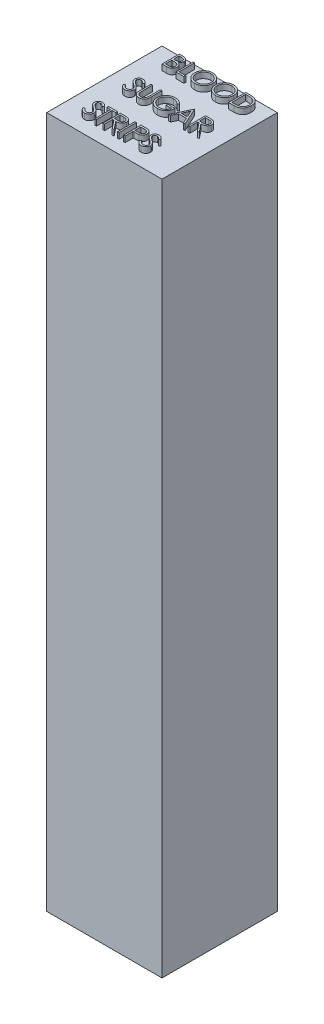
from build123d import *

# Parameters (mm, degrees)
SKETCH1_W           = 10
SKETCH1_H           = 60
BOSS_EXTRUDE1_DEPTH = 10
SKETCH2_W           = 0.134615385
SKETCH2_H           = 1.5
BOSS_EXTRUDE2_DEPTH = 0.5


with BuildPart() as part:
    # Sketch1 → Boss-Extrude1 (new body)
    with BuildSketch(Plane.XY):
        Rectangle(SKETCH1_W, SKETCH1_H)
    extrude(amount=BOSS_EXTRUDE1_DEPTH)

    # Sketch2 → Boss-Extrude2 (add)
    # profile 1 of 16: a face of its own
    with BuildSketch(Plane(origin=(0, 30, 0), x_dir=(1, 0, 0), z_dir=(0, 1, 0))):
        with BuildLine():
            Line((-3.145629099, -0.3505567), (-2.85296083, -0.3505567))
            add(Edge.make_bspline(
                [(-2.85296083, -0.3505567), (-2.83863434, -0.350632022), (-2.810866035, -0.350778014), (-2.770486274, -0.353042213), (-2.732665356, -0.3561295), (-2.69739231, -0.361028111), (-2.664683438, -0.366938873), (-2.634440165, -0.374096794), (-2.606758662, -0.382679628), (-2.573710347, -0.396328034), (-2.536030063, -0.416609392), (-2.495230752, -0.446578777), (-2.460343221, -0.483235547), (-2.430263371, -0.524585257), (-2.406348605, -0.570072016), (-2.389047478, -0.618611668), (-2.378094103, -0.669578129), (-2.376967631, -0.704568063), (-2.37639833, -0.722251412)],
                knots=[0, 0, 0, 0, 1.001505555, 1.941167018, 2.826882275, 3.653841531, 4.429895133, 5.150066043, 5.825578002, 6.45369114, 7.647487171, 8.808567382, 9.977351308, 11.170798116, 12.373658725, 13.556498008, 14.765093433, 16, 16, 16, 16], degree=3))
            add(Edge.make_bspline(
                [(-2.37639833, -0.722251412), (-2.376866852, -0.738816793), (-2.377787543, -0.771369329), (-2.386591582, -0.81898109), (-2.400374726, -0.864303041), (-2.419534119, -0.907169777), (-2.444434974, -0.946612754), (-2.473945682, -0.982950154), (-2.509550026, -1.014643464), (-2.5362257, -1.032361851), (-2.549775734, -1.041361989)],
                knots=[0, 0, 0, 0, 1.044552857, 2.05264487, 3.044412934, 4.028983338, 5.005914585, 5.980388656, 6.974128949, 8, 8, 8, 8], degree=3))
            add(Edge.make_bspline(
                [(-2.549775734, -1.041361989), (-2.532735551, -1.047904131), (-2.500133459, -1.06042087), (-2.455268025, -1.082550355), (-2.416613092, -1.10661983), (-2.383871458, -1.132904909), (-2.355869606, -1.161237257), (-2.331418345, -1.192032306), (-2.310554899, -1.225691773), (-2.292677932, -1.261864717), (-2.278728465, -1.300181775), (-2.268281648, -1.340283536), (-2.262295599, -1.382026202), (-2.261443753, -1.410434222), (-2.261013715, -1.42477545)],
                knots=[0, 0, 0, 0, 1.27268992, 2.434971085, 3.483601985, 4.442670788, 5.356604649, 6.2567628, 7.179492994, 8.113709626, 9.066344395, 10.018646069, 10.999752585, 12, 12, 12, 12], degree=3))
            add(Edge.make_bspline(
                [(-2.261013715, -1.42477545), (-2.261432363, -1.439418395), (-2.262256065, -1.4682288), (-2.268333196, -1.510552429), (-2.278622813, -1.550998835), (-2.292796162, -1.589829628), (-2.311294297, -1.626969685), (-2.333806281, -1.662461084), (-2.36064838, -1.695947226), (-2.390675324, -1.727800207), (-2.424644815, -1.756440687), (-2.461294424, -1.781947419), (-2.501085704, -1.802924303), (-2.54336513, -1.820545455), (-2.58860698, -1.834005683), (-2.636608097, -1.8434225), (-2.687327084, -1.849767516), (-2.722131263, -1.850289175), (-2.739980061, -1.8505567)],
                knots=[0, 0, 0, 0, 0.978564426, 1.925352924, 2.850884081, 3.763762016, 4.682927383, 5.618979971, 6.567305752, 7.547517671, 8.540179244, 9.531824382, 10.526200242, 11.540722885, 12.589160233, 13.674978461, 14.80764778, 16, 16, 16, 16], degree=3))
            Line((-2.739980061, -1.8505567), (-3.145629099, -1.8505567))
            Line((-3.145629099, -1.8505567), (-3.145629099, -0.3505567))
        make_face()
        with BuildLine():
            Line((-3.011013715, -0.504402854), (-3.011013715, -0.985172085))
            Line((-3.011013715, -0.985172085), (-2.920569003, -0.985172085))
            add(Edge.make_bspline(
                [(-2.920569003, -0.985172085), (-2.907348091, -0.985000689), (-2.881802594, -0.984669518), (-2.844808353, -0.983720868), (-2.810469059, -0.981064563), (-2.778843988, -0.978409023), (-2.749982941, -0.974091342), (-2.723949857, -0.968951861), (-2.700336173, -0.96351633), (-2.673104939, -0.954272264), (-2.642216532, -0.940610404), (-2.609288059, -0.919408188), (-2.580259001, -0.894154894), (-2.55574592, -0.86501591), (-2.535683862, -0.832930402), (-2.521749412, -0.79841031), (-2.512300576, -0.762315968), (-2.511447063, -0.737536717), (-2.511013715, -0.724955739)],
                knots=[0, 0, 0, 0, 1.156816544, 2.235205308, 3.236616184, 4.169592532, 5.011045266, 5.787822928, 6.49130361, 7.128639758, 8.301311294, 9.436451833, 10.541879658, 11.654887649, 12.756523258, 13.837046038, 14.901820046, 16, 16, 16, 16], degree=3))
            add(Edge.make_bspline(
                [(-2.511013715, -0.724955739), (-2.511239221, -0.716630408), (-2.511681575, -0.700299363), (-2.515304419, -0.676492497), (-2.521461951, -0.654102317), (-2.529370934, -0.632821984), (-2.540423229, -0.613316905), (-2.553436142, -0.594912679), (-2.56915858, -0.578236056), (-2.587054571, -0.562649129), (-2.607629695, -0.548830045), (-2.630871678, -0.536726861), (-2.657094968, -0.526980814), (-2.68585762, -0.51844532), (-2.717602372, -0.512450337), (-2.751962895, -0.507456028), (-2.789220631, -0.504913424), (-2.814997104, -0.50457684), (-2.828321407, -0.504402854)],
                knots=[0, 0, 0, 0, 0.91205012, 1.789085906, 2.630437955, 3.453916878, 4.269457761, 5.079663411, 5.91843418, 6.774407191, 7.675494373, 8.627863946, 9.638891023, 10.736472738, 11.911756761, 13.175263542, 14.539845004, 16, 16, 16, 16], degree=3))
            Line((-2.828321407, -0.504402854), (-3.011013715, -0.504402854))
        make_face(mode=Mode.SUBTRACT)
        with BuildLine():
            Line((-3.011013715, -1.139018239), (-3.011013715, -1.696710546))
            Line((-3.011013715, -1.696710546), (-2.819306984, -1.696710546))
            add(Edge.make_bspline(
                [(-2.819306984, -1.696710546), (-2.805584587, -1.696546083), (-2.779136476, -1.696229102), (-2.740950235, -1.695194293), (-2.705557476, -1.69284046), (-2.673119704, -1.689135096), (-2.643286653, -1.685115761), (-2.616416208, -1.679710926), (-2.592290554, -1.673518515), (-2.564315851, -1.663946727), (-2.532814347, -1.64907681), (-2.498866837, -1.626656428), (-2.468684172, -1.599946439), (-2.443053347, -1.56903319), (-2.422047781, -1.535419764), (-2.406766871, -1.499786042), (-2.397342218, -1.462720816), (-2.396201289, -1.437449368), (-2.395629099, -1.42477545)],
                knots=[0, 0, 0, 0, 1.160039823, 2.235823828, 3.228722157, 4.157150951, 4.99529583, 5.772374946, 6.472645482, 7.099169577, 8.269452708, 9.405989375, 10.527446681, 11.663510218, 12.788923519, 13.866172445, 14.929861265, 16, 16, 16, 16], degree=3))
            add(Edge.make_bspline(
                [(-2.395629099, -1.42477545), (-2.39574743, -1.416849733), (-2.395982182, -1.401126141), (-2.399522446, -1.378019361), (-2.404671247, -1.355636844), (-2.411327576, -1.333917812), (-2.421021633, -1.313254937), (-2.432338724, -1.293239554), (-2.445607896, -1.273845206), (-2.466283967, -1.249325668), (-2.496357675, -1.22107552), (-2.53908915, -1.19341659), (-2.587677278, -1.171110387), (-2.622917632, -1.161639183), (-2.641121888, -1.156746604)],
                knots=[0, 0, 0, 0, 0.723448775, 1.435228256, 2.130040452, 2.821711965, 3.505591119, 4.210454504, 4.921174351, 5.648778258, 7.137944449, 8.670945889, 10.280296675, 12, 12, 12, 12], degree=3))
            add(Edge.make_bspline(
                [(-2.641121888, -1.156746604), (-2.648420072, -1.155265854), (-2.66424404, -1.152055282), (-2.690047289, -1.148666266), (-2.719505518, -1.145646955), (-2.752686751, -1.143413601), (-2.789632969, -1.141105083), (-2.830423077, -1.140207302), (-2.874890498, -1.139136191), (-2.905744371, -1.139058562), (-2.921770926, -1.139018239)],
                knots=[0, 0, 0, 0, 0.634451884, 1.375622551, 2.216452059, 3.157844607, 4.20941857, 5.370758133, 6.634282058, 8, 8, 8, 8], degree=3))
            Line((-2.921770926, -1.139018239), (-3.011013715, -1.139018239))
        make_face(mode=Mode.SUBTRACT)
    # profile 2 of 16: a face of its own
    with BuildSketch(Plane(origin=(0, 30, 0), x_dir=(1, 0, 0), z_dir=(0, 1, 0))):
        Polygon((-1.953321407, -0.3505567), (-1.818706023, -0.3505567), (-1.818706023, -1.696710546), (-1.241782946, -1.696710546), (-1.241782946, -1.8505567), (-1.953321407, -1.8505567), align=None)
    # profile 3 of 16: a face of its own
    with BuildSketch(Plane(origin=(0, 30, 0), x_dir=(1, 0, 0), z_dir=(0, 1, 0))):
        with BuildLine():
            add(Edge.make_bspline(
                [(-0.289859869, -0.312095162), (-0.262084966, -0.312798653), (-0.207532766, -0.314180367), (-0.12735781, -0.324757126), (-0.050817055, -0.34305515), (0.022713005, -0.367425), (0.092352852, -0.399934022), (0.158626663, -0.439227657), (0.221376752, -0.485717568), (0.279757344, -0.53904438), (0.333181751, -0.59706586), (0.380249988, -0.658984964), (0.419696685, -0.724427308), (0.452090594, -0.793196236), (0.477504284, -0.865136222), (0.495041017, -0.940630794), (0.506243081, -1.019190804), (0.5075527, -1.072773747), (0.508217054, -1.099955739)],
                knots=[0, 0, 0, 0, 1.065120563, 2.091984664, 3.0946048, 4.079830382, 5.057816894, 6.036188127, 7.030412546, 8.04752943, 9.064399622, 10.05169764, 11.02544977, 11.989514704, 12.962713494, 13.945757189, 14.957906945, 16, 16, 16, 16], degree=3))
            add(Edge.make_bspline(
                [(0.508217054, -1.099955739), (0.507552798, -1.126937501), (0.506243471, -1.180121681), (0.49502828, -1.258183158), (0.47743928, -1.333222027), (0.452326595, -1.405113022), (0.420087104, -1.473931977), (0.380377745, -1.539497815), (0.33360294, -1.601832028), (0.280371433, -1.660251742), (0.222342415, -1.713822087), (0.160100872, -1.760501605), (0.095046592, -1.800669087), (0.026342431, -1.832719233), (-0.045100442, -1.85833577), (-0.119921437, -1.875801183), (-0.197769961, -1.887067059), (-0.250857534, -1.888360708), (-0.277840638, -1.889018239)],
                knots=[0, 0, 0, 0, 1.043624062, 2.057103931, 3.04512605, 4.022047818, 4.998200453, 5.980619268, 6.982898556, 8.009068085, 9.034988726, 10.034168286, 11.015286542, 11.987931943, 12.962482838, 13.94673481, 14.956375938, 16, 16, 16, 16], degree=3))
            add(Edge.make_bspline(
                [(-0.277840638, -1.889018239), (-0.305022489, -1.888354216), (-0.358605153, -1.88704525), (-0.437263882, -1.875824648), (-0.512811487, -1.858278375), (-0.585031923, -1.833202902), (-0.653965464, -1.800795517), (-0.719746928, -1.761279355), (-0.782112277, -1.71439058), (-0.840544454, -1.661176334), (-0.894008396, -1.603245669), (-0.940619557, -1.541173845), (-0.980144606, -1.476178649), (-1.012443177, -1.40807971), (-1.03801366, -1.337206235), (-1.055458582, -1.263085459), (-1.066745418, -1.186139956), (-1.068046067, -1.133750143), (-1.068706023, -1.107167277)],
                knots=[0, 0, 0, 0, 1.053102029, 2.075944431, 3.073151272, 4.055350789, 5.033113405, 6.020478099, 7.024410459, 8.052272461, 9.079885166, 10.07527673, 11.055994387, 12.023226415, 12.992069828, 13.970394897, 14.97016774, 16, 16, 16, 16], degree=3))
            add(Edge.make_bspline(
                [(-1.068706023, -1.107167277), (-1.068476893, -1.089324705), (-1.068021525, -1.053864652), (-1.062539371, -1.001207537), (-1.054584356, -0.949397255), (-1.043183536, -0.898581135), (-1.028272822, -0.84888357), (-1.010679096, -0.799961814), (-0.989190591, -0.752311647), (-0.964898884, -0.705707336), (-0.937786681, -0.660875377), (-0.907839931, -0.618498413), (-0.876110487, -0.578220842), (-0.841326176, -0.541086412), (-0.804633414, -0.506014845), (-0.765436966, -0.473545109), (-0.723976004, -0.443384416), (-0.680072127, -0.41620427), (-0.634807152, -0.391621784), (-0.588145676, -0.370526705), (-0.540721431, -0.35242125), (-0.492312296, -0.33774661), (-0.443046822, -0.326161452), (-0.392817486, -0.318272586), (-0.341664303, -0.31277645), (-0.30720231, -0.312323235), (-0.289859869, -0.312095162)],
                knots=[0, 0, 0, 0, 1.037015668, 2.060948919, 3.074880161, 4.083647147, 5.086022904, 6.090072063, 7.104153813, 8.122640571, 9.144368836, 10.147691507, 11.138137339, 12.123020368, 13.103399296, 14.087645067, 15.080126199, 16.082011238, 17.087798457, 18.072939717, 19.057185487, 20.037253025, 21.01195951, 21.997135196, 22.992090687, 24, 24, 24, 24], degree=3))
        make_face()
        with BuildLine():
            add(Edge.make_bspline(
                [(-0.283249292, -0.465941315), (-0.297484135, -0.46611484), (-0.325817735, -0.46646023), (-0.367939679, -0.471009822), (-0.40950765, -0.47749406), (-0.450530234, -0.486743283), (-0.490835787, -0.49934502), (-0.530800004, -0.513848267), (-0.570058456, -0.531514448), (-0.608481538, -0.551474179), (-0.645730856, -0.573566573), (-0.680879156, -0.597983045), (-0.714017432, -0.624150997), (-0.745064547, -0.652131499), (-0.773929335, -0.682067042), (-0.801179921, -0.713503801), (-0.825724028, -0.747340325), (-0.848217846, -0.782659071), (-0.868346921, -0.819414035), (-0.886246358, -0.857218261), (-0.900888076, -0.896380127), (-0.912829095, -0.936474766), (-0.922729014, -0.977438677), (-0.929000695, -1.019582612), (-0.933600278, -1.062694803), (-0.933925926, -1.091829884), (-0.934090638, -1.106566315)],
                knots=[0, 0, 0, 0, 1.008559885, 2.007477868, 2.99961109, 3.989939068, 4.984837346, 5.991145699, 7.001802488, 8.033829008, 9.059044045, 10.069351652, 11.065060232, 12.050310815, 13.029377138, 14.011219647, 14.996725999, 15.989392538, 16.977580475, 17.965360261, 18.951710183, 19.937753436, 20.929683414, 21.935841486, 22.955955122, 24, 24, 24, 24], degree=3))
            add(Edge.make_bspline(
                [(-0.934090638, -1.106566315), (-0.933544268, -1.128235839), (-0.932469391, -1.170866495), (-0.923059004, -1.233338556), (-0.908563872, -1.293376393), (-0.887196429, -1.350651497), (-0.860474737, -1.40565619), (-0.827463213, -1.45790252), (-0.788352176, -1.507404609), (-0.74392495, -1.553816868), (-0.695358076, -1.596179355), (-0.643786906, -1.633363673), (-0.589763931, -1.664825209), (-0.533148273, -1.690455954), (-0.474242185, -1.710765842), (-0.412666092, -1.724685255), (-0.34883018, -1.733846164), (-0.305317042, -1.734725917), (-0.283249292, -1.735172085)],
                knots=[0, 0, 0, 0, 1.032063989, 2.030389145, 3.003944642, 3.970395727, 4.937377036, 5.913328081, 6.909231446, 7.93887556, 8.970685674, 9.976071282, 10.964166581, 11.944589148, 12.933237628, 13.927779006, 14.949070134, 16, 16, 16, 16], degree=3))
            add(Edge.make_bspline(
                [(-0.283249292, -1.735172085), (-0.268416648, -1.734968297), (-0.238999061, -1.734564125), (-0.195243837, -1.730493264), (-0.152276889, -1.72396532), (-0.110158484, -1.714566467), (-0.068936422, -1.702803379), (-0.028438649, -1.688828638), (0.010903475, -1.671393837), (0.049586263, -1.652130429), (0.086613224, -1.630170361), (0.12195988, -1.606582583), (0.1547353, -1.580453174), (0.185759188, -1.552888397), (0.214742483, -1.523332462), (0.241489191, -1.491823796), (0.265909248, -1.458163514), (0.288394525, -1.42289834), (0.308453066, -1.386042803), (0.325929823, -1.348101513), (0.340756729, -1.309167895), (0.352726089, -1.269185793), (0.362105572, -1.228231143), (0.368568395, -1.18624911), (0.373089154, -1.143323677), (0.373429902, -1.114290596), (0.37360167, -1.099655258)],
                knots=[0, 0, 0, 0, 1.047197238, 2.076906641, 3.100256066, 4.114471768, 5.12198147, 6.126382909, 7.136867548, 8.15857795, 9.17633901, 10.174870724, 11.156907918, 12.133735059, 13.104061851, 14.077631395, 15.04955518, 16.038496417, 17.029181396, 18.010275684, 18.986308667, 19.968651475, 20.955262928, 21.950658345, 22.966943676, 24, 24, 24, 24], degree=3))
            add(Edge.make_bspline(
                [(0.37360167, -1.099655258), (0.373429764, -1.085120042), (0.373088758, -1.056286763), (0.368570554, -1.013660698), (0.362098744, -0.97198075), (0.352771869, -0.931410549), (0.340750375, -0.891939753), (0.325927233, -0.853605432), (0.308447819, -0.816264777), (0.288387152, -0.780010078), (0.265837513, -0.745220905), (0.241197123, -0.711962728), (0.214040545, -0.680860125), (0.185143678, -0.651145256), (0.153784727, -0.623451875), (0.120105743, -0.597770794), (0.084515596, -0.573482248), (0.046832495, -0.551571293), (0.007942229, -0.531336622), (-0.031963753, -0.514000478), (-0.072433367, -0.499269569), (-0.113363701, -0.486705156), (-0.155099263, -0.477530286), (-0.197358047, -0.471003979), (-0.240081586, -0.466461813), (-0.268814395, -0.466115365), (-0.283249292, -0.465941315)],
                knots=[0, 0, 0, 0, 1.02996197, 2.043119294, 3.035359645, 4.018872909, 4.991431989, 5.957985074, 6.929999688, 7.912076566, 8.892894881, 9.867085534, 10.843653904, 11.817741046, 12.803660682, 13.806313499, 14.818574707, 15.856120519, 16.894564902, 17.924820532, 18.937903209, 19.946497019, 20.957711757, 21.963978472, 22.977135795, 24, 24, 24, 24], degree=3))
        make_face(mode=Mode.SUBTRACT)
    # profile 4 of 16: a face of its own
    with BuildSketch(Plane(origin=(0, 30, 0), x_dir=(1, 0, 0), z_dir=(0, 1, 0))):
        with BuildLine():
            add(Edge.make_bspline(
                [(1.517832439, -0.312095162), (1.545607342, -0.312798653), (1.600159542, -0.314180367), (1.680334498, -0.324757126), (1.756875253, -0.34305515), (1.830405312, -0.367425), (1.90004516, -0.399934022), (1.966318971, -0.439227657), (2.029069059, -0.485717568), (2.087449651, -0.53904438), (2.140874059, -0.59706586), (2.187942296, -0.658984964), (2.227388993, -0.724427308), (2.259782902, -0.793196236), (2.285196592, -0.865136222), (2.302733325, -0.940630794), (2.313935389, -1.019190804), (2.315245008, -1.072773747), (2.315909362, -1.099955739)],
                knots=[0, 0, 0, 0, 1.065120563, 2.091984664, 3.0946048, 4.079830382, 5.057816894, 6.036188127, 7.030412546, 8.04752943, 9.064399622, 10.05169764, 11.02544977, 11.989514704, 12.962713494, 13.945757189, 14.957906945, 16, 16, 16, 16], degree=3))
            add(Edge.make_bspline(
                [(2.315909362, -1.099955739), (2.315245105, -1.126937501), (2.313935778, -1.180121681), (2.302720588, -1.258183158), (2.285131588, -1.333222027), (2.260018902, -1.405113022), (2.227779412, -1.473931977), (2.188070053, -1.539497815), (2.141295248, -1.601832028), (2.08806374, -1.660251742), (2.030034722, -1.713822087), (1.967793179, -1.760501605), (1.902738899, -1.800669087), (1.834034739, -1.832719233), (1.762591866, -1.85833577), (1.68777087, -1.875801183), (1.609922347, -1.887067059), (1.556834774, -1.888360708), (1.52985167, -1.889018239)],
                knots=[0, 0, 0, 0, 1.043624062, 2.057103931, 3.04512605, 4.022047818, 4.998200453, 5.980619268, 6.982898556, 8.009068085, 9.034988726, 10.034168286, 11.015286542, 11.987931943, 12.962482838, 13.94673481, 14.956375938, 16, 16, 16, 16], degree=3))
            add(Edge.make_bspline(
                [(1.52985167, -1.889018239), (1.502669819, -1.888354216), (1.449087155, -1.88704525), (1.370428425, -1.875824648), (1.294880821, -1.858278375), (1.222660385, -1.833202902), (1.153726843, -1.800795517), (1.087945379, -1.761279355), (1.025580031, -1.71439058), (0.967147853, -1.661176334), (0.913683911, -1.603245669), (0.86707275, -1.541173845), (0.827547702, -1.476178649), (0.795249131, -1.40807971), (0.769678648, -1.337206235), (0.752233726, -1.263085459), (0.74094689, -1.186139956), (0.739646241, -1.133750143), (0.738986285, -1.107167277)],
                knots=[0, 0, 0, 0, 1.053102029, 2.075944431, 3.073151272, 4.055350789, 5.033113405, 6.020478099, 7.024410459, 8.052272461, 9.079885166, 10.07527673, 11.055994387, 12.023226415, 12.992069828, 13.970394897, 14.97016774, 16, 16, 16, 16], degree=3))
            add(Edge.make_bspline(
                [(0.738986285, -1.107167277), (0.739215415, -1.089324705), (0.739670783, -1.053864652), (0.745152937, -1.001207537), (0.753107952, -0.949397255), (0.764508771, -0.898581135), (0.779419486, -0.84888357), (0.797013212, -0.799961814), (0.818501717, -0.752311647), (0.842793423, -0.705707336), (0.869905627, -0.660875377), (0.899852377, -0.618498413), (0.93158182, -0.578220842), (0.966366132, -0.541086412), (1.003058894, -0.506014845), (1.042255342, -0.473545109), (1.083716304, -0.443384416), (1.127620181, -0.41620427), (1.172885156, -0.391621784), (1.219546632, -0.370526705), (1.266970877, -0.35242125), (1.315380012, -0.33774661), (1.364645485, -0.326161452), (1.414874822, -0.318272586), (1.466028004, -0.31277645), (1.500489998, -0.312323235), (1.517832439, -0.312095162)],
                knots=[0, 0, 0, 0, 1.037015668, 2.060948919, 3.074880161, 4.083647147, 5.086022904, 6.090072063, 7.104153813, 8.122640571, 9.144368836, 10.147691507, 11.138137339, 12.123020368, 13.103399296, 14.087645067, 15.080126199, 16.082011238, 17.087798457, 18.072939717, 19.057185487, 20.037253025, 21.01195951, 21.997135196, 22.992090687, 24, 24, 24, 24], degree=3))
        make_face()
        with BuildLine():
            add(Edge.make_bspline(
                [(1.524443016, -0.465941315), (1.510208173, -0.46611484), (1.481874573, -0.46646023), (1.439752629, -0.471009822), (1.398184657, -0.47749406), (1.357162074, -0.486743283), (1.316856521, -0.49934502), (1.276892303, -0.513848267), (1.237633852, -0.531514448), (1.19921077, -0.551474179), (1.161961452, -0.573566573), (1.126813151, -0.597983045), (1.093674875, -0.624150997), (1.062627761, -0.652131499), (1.033762973, -0.682067042), (1.006512387, -0.713503801), (0.98196828, -0.747340325), (0.959474462, -0.782659071), (0.939345387, -0.819414035), (0.921445949, -0.857218261), (0.906804231, -0.896380127), (0.894863213, -0.936474766), (0.884963294, -0.977438677), (0.878691612, -1.019582612), (0.87409203, -1.062694803), (0.873766382, -1.091829884), (0.87360167, -1.106566315)],
                knots=[0, 0, 0, 0, 1.008559885, 2.007477868, 2.99961109, 3.989939068, 4.984837346, 5.991145699, 7.001802488, 8.033829008, 9.059044045, 10.069351652, 11.065060232, 12.050310815, 13.029377138, 14.011219647, 14.996725999, 15.989392538, 16.977580475, 17.965360261, 18.951710183, 19.937753436, 20.929683414, 21.935841486, 22.955955122, 24, 24, 24, 24], degree=3))
            add(Edge.make_bspline(
                [(0.87360167, -1.106566315), (0.874148039, -1.128235839), (0.875222917, -1.170866495), (0.884633304, -1.233338556), (0.899128436, -1.293376393), (0.920495879, -1.350651497), (0.947217571, -1.40565619), (0.980229095, -1.45790252), (1.019340132, -1.507404609), (1.063767357, -1.553816868), (1.112334232, -1.596179355), (1.163905402, -1.633363673), (1.217928376, -1.664825209), (1.274544035, -1.690455954), (1.333450123, -1.710765842), (1.395026216, -1.724685255), (1.458862127, -1.733846164), (1.502375265, -1.734725917), (1.524443016, -1.735172085)],
                knots=[0, 0, 0, 0, 1.032063989, 2.030389145, 3.003944642, 3.970395727, 4.937377036, 5.913328081, 6.909231446, 7.93887556, 8.970685674, 9.976071282, 10.964166581, 11.944589148, 12.933237628, 13.927779006, 14.949070134, 16, 16, 16, 16], degree=3))
            add(Edge.make_bspline(
                [(1.524443016, -1.735172085), (1.539275659, -1.734968297), (1.568693247, -1.734564125), (1.61244847, -1.730493264), (1.655415418, -1.72396532), (1.697533824, -1.714566467), (1.738755886, -1.702803379), (1.779253659, -1.688828638), (1.818595783, -1.671393837), (1.857278571, -1.652130429), (1.894305531, -1.630170361), (1.929652188, -1.606582583), (1.962427608, -1.580453174), (1.993451496, -1.552888397), (2.022434791, -1.523332462), (2.049181499, -1.491823796), (2.073601555, -1.458163514), (2.096086832, -1.42289834), (2.116145374, -1.386042803), (2.13362213, -1.348101513), (2.148449037, -1.309167895), (2.160418396, -1.269185793), (2.16979788, -1.228231143), (2.176260703, -1.18624911), (2.180781462, -1.143323677), (2.18112221, -1.114290596), (2.181293977, -1.099655258)],
                knots=[0, 0, 0, 0, 1.047197238, 2.076906641, 3.100256066, 4.114471768, 5.12198147, 6.126382909, 7.136867548, 8.15857795, 9.17633901, 10.174870724, 11.156907918, 12.133735059, 13.104061851, 14.077631395, 15.04955518, 16.038496417, 17.029181396, 18.010275684, 18.986308667, 19.968651475, 20.955262928, 21.950658345, 22.966943676, 24, 24, 24, 24], degree=3))
            add(Edge.make_bspline(
                [(2.181293977, -1.099655258), (2.181122072, -1.085120042), (2.180781066, -1.056286763), (2.176262862, -1.013660698), (2.169791052, -0.97198075), (2.160464177, -0.931410549), (2.148442683, -0.891939753), (2.133619541, -0.853605432), (2.116140127, -0.816264777), (2.096079459, -0.780010078), (2.073529821, -0.745220905), (2.048889431, -0.711962728), (2.021732853, -0.680860125), (1.992835985, -0.651145256), (1.961477034, -0.623451875), (1.927798051, -0.597770794), (1.892207904, -0.573482248), (1.854524803, -0.551571293), (1.815634537, -0.531336622), (1.775728555, -0.514000478), (1.735258941, -0.499269569), (1.694328607, -0.486705156), (1.652593045, -0.477530286), (1.610334261, -0.471003979), (1.567610721, -0.466461813), (1.538877913, -0.466115365), (1.524443016, -0.465941315)],
                knots=[0, 0, 0, 0, 1.02996197, 2.043119294, 3.035359645, 4.018872909, 4.991431989, 5.957985074, 6.929999688, 7.912076566, 8.892894881, 9.867085534, 10.843653904, 11.817741046, 12.803660682, 13.806313499, 14.818574707, 15.856120519, 16.894564902, 17.924820532, 18.937903209, 19.946497019, 20.957711757, 21.963978472, 22.977135795, 24, 24, 24, 24], degree=3))
        make_face(mode=Mode.SUBTRACT)
    # profile 5 of 16: a face of its own
    with BuildSketch(Plane(origin=(0, 30, 0), x_dir=(1, 0, 0), z_dir=(0, 1, 0))):
        with BuildLine():
            Line((2.62360167, -1.8505567), (2.62360167, -0.3505567))
            Line((2.62360167, -0.3505567), (2.926486285, -0.3505567))
            add(Edge.make_bspline(
                [(2.926486285, -0.3505567), (2.952830137, -0.350746373), (3.003726322, -0.35111282), (3.077274514, -0.353436273), (3.145324698, -0.357546473), (3.207653066, -0.363533413), (3.264430729, -0.370884713), (3.315498703, -0.380099172), (3.36112105, -0.390979816), (3.389179382, -0.400256438), (3.402447824, -0.404643239)],
                knots=[0, 0, 0, 0, 1.314313732, 2.53924729, 3.670748893, 4.714932338, 5.66265055, 6.526160246, 7.303039223, 8, 8, 8, 8], degree=3))
            add(Edge.make_bspline(
                [(3.402447824, -0.404643239), (3.419802712, -0.411256398), (3.454118937, -0.424332753), (3.502979133, -0.448999739), (3.548975717, -0.476948211), (3.59235535, -0.508215009), (3.632127133, -0.543685445), (3.669844803, -0.581852767), (3.703965399, -0.624104913), (3.735211811, -0.669565622), (3.763384237, -0.717699359), (3.787872447, -0.768414405), (3.808209873, -0.821453209), (3.825092685, -0.876668272), (3.838398309, -0.934181005), (3.84747628, -0.994058377), (3.853463847, -1.056063743), (3.854065583, -1.098138514), (3.854370901, -1.119486989)],
                knots=[0, 0, 0, 0, 0.984719456, 1.947108742, 2.898477687, 3.838006223, 4.779231079, 5.722358779, 6.681677486, 7.655904652, 8.64651281, 9.637519902, 10.640069247, 11.656948941, 12.698408672, 13.768548281, 14.867775369, 16, 16, 16, 16], degree=3))
            add(Edge.make_bspline(
                [(3.854370901, -1.119486989), (3.854101343, -1.138027519), (3.853570152, -1.174563572), (3.848800445, -1.22840967), (3.841867736, -1.280658343), (3.831134509, -1.331060786), (3.81810486, -1.380058594), (3.801405938, -1.427129556), (3.78227644, -1.472705474), (3.759969349, -1.516170107), (3.735480184, -1.557348695), (3.709199437, -1.596166778), (3.681155139, -1.632070445), (3.651079868, -1.665168421), (3.619362275, -1.695410812), (3.585794705, -1.723050247), (3.55029054, -1.747545913), (3.513008802, -1.769860388), (3.472861889, -1.789326255), (3.429089375, -1.805796259), (3.381504585, -1.819444809), (3.330224317, -1.830832335), (3.27515997, -1.839865465), (3.216257556, -1.845919633), (3.153607575, -1.850013747), (3.110587889, -1.850372202), (3.08844542, -1.8505567)],
                knots=[0, 0, 0, 0, 1.105936401, 2.179363191, 3.223086493, 4.248585256, 5.251745608, 6.245858792, 7.225916811, 8.198733463, 9.158002045, 10.082870192, 10.993790845, 11.873723703, 12.748670949, 13.606408763, 14.465103618, 15.319838547, 16.196477973, 17.123216899, 18.106603292, 19.147568657, 20.255746949, 21.433717677, 22.679120308, 24, 24, 24, 24], degree=3))
            Line((3.08844542, -1.8505567), (2.62360167, -1.8505567))
        make_face()
        with BuildLine():
            Line((2.758217054, -1.696710546), (2.930392535, -1.696710546))
            add(Edge.make_bspline(
                [(2.930392535, -1.696710546), (2.955133265, -1.696604219), (3.002718751, -1.696399713), (3.071143607, -1.694605198), (3.133663348, -1.691672939), (3.190286852, -1.687569334), (3.240982148, -1.682139928), (3.285855184, -1.676086398), (3.324758866, -1.668544633), (3.348300053, -1.661708508), (3.359178593, -1.658549489)],
                knots=[0, 0, 0, 0, 1.375205317, 2.645023457, 3.804390687, 4.853969522, 5.800190428, 6.637939096, 7.370582563, 8, 8, 8, 8], degree=3))
            add(Edge.make_bspline(
                [(3.359178593, -1.658549489), (3.372870748, -1.653727392), (3.399928022, -1.644198375), (3.438877058, -1.62681652), (3.475201489, -1.606227062), (3.509534357, -1.583340373), (3.541388638, -1.557349229), (3.57114183, -1.528818805), (3.598734031, -1.497603902), (3.623880163, -1.463743261), (3.646383722, -1.427447634), (3.665871391, -1.389073849), (3.682950619, -1.349042359), (3.69635573, -1.306738433), (3.706862409, -1.262540266), (3.714304418, -1.216444746), (3.7189393, -1.168460482), (3.719479921, -1.135823857), (3.719755516, -1.119186508)],
                knots=[0, 0, 0, 0, 0.998632004, 1.973411704, 2.929992603, 3.868527914, 4.809262121, 5.754881198, 6.702106254, 7.672490631, 8.653608572, 9.636854334, 10.631411391, 11.644891563, 12.686317036, 13.754757253, 14.855430412, 16, 16, 16, 16], degree=3))
            add(Edge.make_bspline(
                [(3.719755516, -1.119186508), (3.719535536, -1.101643588), (3.719103382, -1.067180366), (3.713671535, -1.016612925), (3.705733726, -0.96797836), (3.694255003, -0.92127342), (3.679627483, -0.876406983), (3.661372637, -0.833627193), (3.640515514, -0.792482249), (3.615699799, -0.753921807), (3.588521687, -0.717453331), (3.558359739, -0.684044082), (3.525693151, -0.653617953), (3.490878216, -0.625701105), (3.452933744, -0.601416672), (3.412753591, -0.579693809), (3.369748304, -0.561258427), (3.339828577, -0.5514532), (3.324623304, -0.546470162)],
                knots=[0, 0, 0, 0, 1.122418816, 2.205001699, 3.251619955, 4.274784885, 5.280384055, 6.268708349, 7.249350384, 8.229342522, 9.199999885, 10.157847722, 11.105861043, 12.055065948, 13.010012805, 13.98527497, 14.976112212, 16, 16, 16, 16], degree=3))
            add(Edge.make_bspline(
                [(3.324623304, -0.546470162), (3.312044242, -0.542991693), (3.285297703, -0.535595513), (3.241652218, -0.527527496), (3.19253144, -0.520411282), (3.137717282, -0.514386408), (3.077272229, -0.510063271), (3.011149791, -0.506818421), (2.939321389, -0.504629865), (2.889528874, -0.504480419), (2.863685804, -0.504402854)],
                knots=[0, 0, 0, 0, 0.674548936, 1.434276114, 2.292660221, 3.240891867, 4.284742987, 5.42552168, 6.663806718, 8, 8, 8, 8], degree=3))
            Line((2.863685804, -0.504402854), (2.758217054, -0.504402854))
            Line((2.758217054, -0.504402854), (2.758217054, -1.696710546))
        make_face(mode=Mode.SUBTRACT)
    # profile 6 of 16: a face of its own
    with BuildSketch(Plane(origin=(0, 30, 0), x_dir=(1, 0, 0), z_dir=(0, 1, 0))):
        with BuildLine():
            Line((-3.299475253, -5.061193719), (-3.172672369, -4.985172085))
            add(Edge.make_bspline(
                [(-3.172672369, -4.985172085), (-3.160878838, -5.004913964), (-3.13828289, -5.042738643), (-3.10058945, -5.093849232), (-3.061532488, -5.137290156), (-3.020822774, -5.172808702), (-2.978708796, -5.200772511), (-2.93491563, -5.220573467), (-2.889590854, -5.232923171), (-2.85874493, -5.234423208), (-2.843345446, -5.235172085)],
                knots=[0, 0, 0, 0, 1.272034388, 2.437168799, 3.508375237, 4.49857839, 5.41946034, 6.295179144, 7.148887113, 8, 8, 8, 8], degree=3))
            add(Edge.make_bspline(
                [(-2.843345446, -5.235172085), (-2.830193934, -5.234805797), (-2.804121031, -5.234079629), (-2.765737213, -5.227102143), (-2.728459298, -5.216382659), (-2.693055596, -5.201030831), (-2.660014618, -5.182457194), (-2.63104032, -5.160023118), (-2.605991986, -5.134906173), (-2.585502365, -5.106885035), (-2.56978235, -5.076749114), (-2.557700035, -5.045816564), (-2.550995004, -5.013601463), (-2.549984966, -4.991911265), (-2.549475253, -4.980965354)],
                knots=[0, 0, 0, 0, 1.095163259, 2.171163733, 3.241058638, 4.321873601, 5.38011039, 6.391990106, 7.366004449, 8.327778327, 9.272591725, 10.192022065, 11.087607919, 12, 12, 12, 12], degree=3))
            add(Edge.make_bspline(
                [(-2.549475253, -4.980965354), (-2.550107101, -4.968476418), (-2.551391554, -4.943088237), (-2.562247903, -4.905631243), (-2.579326152, -4.868562999), (-2.59508157, -4.845633885), (-2.603261311, -4.833729777)],
                knots=[0, 0, 0, 0, 0.938893495, 1.908633276, 2.914225137, 4, 4, 4, 4], degree=3))
            add(Edge.make_bspline(
                [(-2.603261311, -4.833729777), (-2.609977288, -4.825138281), (-2.624076643, -4.80710151), (-2.648315577, -4.780253552), (-2.676758198, -4.752559944), (-2.70843115, -4.722963206), (-2.744488188, -4.692839864), (-2.78379998, -4.660753459), (-2.827370205, -4.627924212), (-2.857927132, -4.605907398), (-2.873694003, -4.594547085)],
                knots=[0, 0, 0, 0, 0.722233717, 1.516239348, 2.393582979, 3.351407094, 4.387010283, 5.505090956, 6.712668013, 8, 8, 8, 8], degree=3))
            add(Edge.make_bspline(
                [(-2.873694003, -4.594547085), (-2.889475716, -4.583306261), (-2.919649149, -4.561814663), (-2.961845684, -4.529918542), (-2.999579025, -4.500756883), (-3.032681461, -4.474055164), (-3.061138431, -4.449809762), (-3.085174179, -4.428253502), (-3.104176417, -4.408803405), (-3.114743095, -4.396185687), (-3.119487273, -4.390520642)],
                knots=[0, 0, 0, 0, 1.452282411, 2.77665338, 3.964542531, 5.026858415, 5.96415736, 6.766646006, 7.446254459, 8, 8, 8, 8], degree=3))
            add(Edge.make_bspline(
                [(-3.119487273, -4.390520642), (-3.126118363, -4.381691627), (-3.139159293, -4.364328182), (-3.156373296, -4.337188957), (-3.171004365, -4.309407558), (-3.182473936, -4.28090933), (-3.192132316, -4.252094361), (-3.198628572, -4.222586684), (-3.202696313, -4.192518705), (-3.203112879, -4.172284347), (-3.203321407, -4.162155258)],
                knots=[0, 0, 0, 0, 1.068054152, 2.10047183, 3.106115577, 4.101338837, 5.06977816, 6.043150881, 7.020423561, 8, 8, 8, 8], degree=3))
            add(Edge.make_bspline(
                [(-3.203321407, -4.162155258), (-3.202762032, -4.146285354), (-3.201655238, -4.114884756), (-3.192295016, -4.0690144), (-3.177520919, -4.025220221), (-3.156823109, -3.983935792), (-3.130141387, -3.946236086), (-3.099264541, -3.911687449), (-3.062488189, -3.882643771), (-3.022137065, -3.857267174), (-2.977970049, -3.837404635), (-2.931688233, -3.822421358), (-2.883218059, -3.813931676), (-2.850388144, -3.812713348), (-2.833730061, -3.812095162)],
                knots=[0, 0, 0, 0, 1.005424448, 1.989358655, 2.955360095, 3.929531133, 4.905563448, 5.876582895, 6.856512386, 7.866279853, 8.892233794, 9.918561126, 10.94386622, 12, 12, 12, 12], degree=3))
            add(Edge.make_bspline(
                [(-2.833730061, -3.812095162), (-2.816054018, -3.812704827), (-2.78090201, -3.813917256), (-2.729195203, -3.824459055), (-2.679412039, -3.8419022), (-2.639364926, -3.861697339), (-2.608022314, -3.881467946), (-2.584119714, -3.899476442), (-2.559897949, -3.920208631), (-2.53516164, -3.943719737), (-2.510329929, -3.970225487), (-2.485034164, -3.999544354), (-2.459215191, -4.031497163), (-2.442605537, -4.054307664), (-2.434090638, -4.066001412)],
                knots=[0, 0, 0, 0, 1.286793592, 2.559021753, 3.825965368, 5.121522368, 5.803751409, 6.523245864, 7.299691795, 8.125521123, 9.008227632, 9.944561021, 10.946284179, 12, 12, 12, 12], degree=3))
            Line((-2.434090638, -4.066001412), (-2.555785349, -4.158249008))
            add(Edge.make_bspline(
                [(-2.555785349, -4.158249008), (-2.563133606, -4.148782426), (-2.577284631, -4.130552003), (-2.598768696, -4.10502144), (-2.619018117, -4.081700091), (-2.638968288, -4.061443608), (-2.657565559, -4.043142693), (-2.67561572, -4.027474226), (-2.692859013, -4.014284685), (-2.714594832, -4.000208874), (-2.741902426, -3.986256087), (-2.776181513, -3.974449339), (-2.812004202, -3.967354312), (-2.836402615, -3.966416218), (-2.848754099, -3.965941315)],
                knots=[0, 0, 0, 0, 1.181633172, 2.275549214, 3.290209073, 4.226197932, 5.078386478, 5.862611352, 6.581680152, 7.217281963, 8.414376989, 9.595101626, 10.782541182, 12, 12, 12, 12], degree=3))
            add(Edge.make_bspline(
                [(-2.848754099, -3.965941315), (-2.864249752, -3.966460615), (-2.894131658, -3.967462037), (-2.936556045, -3.978399173), (-2.974739156, -3.99561997), (-3.007547398, -4.019754961), (-3.034863245, -4.048349672), (-3.054622727, -4.081254896), (-3.066515655, -4.117590211), (-3.067966918, -4.142936635), (-3.068706023, -4.155845162)],
                knots=[0, 0, 0, 0, 1.14458467, 2.207223713, 3.21896685, 4.227309161, 5.202851033, 6.127160689, 7.046193047, 8, 8, 8, 8], degree=3))
            add(Edge.make_bspline(
                [(-3.068706023, -4.155845162), (-3.06853754, -4.16388151), (-3.068200298, -4.179967346), (-3.063496814, -4.203732242), (-3.057454244, -4.227437101), (-3.047878831, -4.250975351), (-3.034659415, -4.274758648), (-3.017300054, -4.299196535), (-2.995437206, -4.324504411), (-2.978689915, -4.340964714), (-2.969847849, -4.349655258)],
                knots=[0, 0, 0, 0, 0.858281714, 1.717966888, 2.583508476, 3.4729293, 4.427298488, 5.488583878, 6.674047936, 8, 8, 8, 8], degree=3))
            add(Edge.make_bspline(
                [(-2.969847849, -4.349655258), (-2.966564404, -4.352585412), (-2.95876369, -4.359546787), (-2.944502579, -4.370943478), (-2.925669951, -4.385001809), (-2.902757579, -4.402396374), (-2.875342995, -4.422574143), (-2.843423185, -4.44527712), (-2.807353957, -4.471242316), (-2.78175885, -4.489395548), (-2.768225253, -4.4989942)],
                knots=[0, 0, 0, 0, 0.420754252, 0.999615792, 1.744751191, 2.668019286, 3.750313428, 4.999500688, 6.413464383, 8, 8, 8, 8], degree=3))
            add(Edge.make_bspline(
                [(-2.768225253, -4.4989942), (-2.751945576, -4.510840497), (-2.720422238, -4.533779209), (-2.675568989, -4.568243072), (-2.634900214, -4.601949259), (-2.598273127, -4.634682519), (-2.565325881, -4.666194559), (-2.536424, -4.696864493), (-2.511272994, -4.726472596), (-2.484196186, -4.764432271), (-2.45652855, -4.811052736), (-2.432767904, -4.868171981), (-2.417785755, -4.925513261), (-2.415826534, -4.964053334), (-2.414859869, -4.983068719)],
                knots=[0, 0, 0, 0, 1.163667725, 2.253281268, 3.268753668, 4.215851969, 5.092017293, 5.902905408, 6.650798638, 7.335211899, 8.59617414, 9.77448103, 10.901945474, 12, 12, 12, 12], degree=3))
            add(Edge.make_bspline(
                [(-2.414859869, -4.983068719), (-2.415141499, -4.99651659), (-2.415699291, -5.023151183), (-2.422111112, -5.062260502), (-2.431505254, -5.10024516), (-2.445664068, -5.136635637), (-2.462945422, -5.172097678), (-2.484873814, -5.205701064), (-2.510291393, -5.23818952), (-2.539448721, -5.268696731), (-2.571354108, -5.296702244), (-2.605075691, -5.321614699), (-2.640668665, -5.342386837), (-2.677939944, -5.359337198), (-2.716898088, -5.37259442), (-2.757529995, -5.382199935), (-2.799902643, -5.38809524), (-2.828702849, -5.388707138), (-2.843345446, -5.389018239)],
                knots=[0, 0, 0, 0, 0.983748083, 1.948392443, 2.894712957, 3.844097841, 4.80183111, 5.778335162, 6.776009319, 7.81870978, 8.863265674, 9.881300176, 10.883814829, 11.87499822, 12.874611388, 13.892143829, 14.928324115, 16, 16, 16, 16], degree=3))
            add(Edge.make_bspline(
                [(-2.843345446, -5.389018239), (-2.854674878, -5.388799161), (-2.877191061, -5.388363764), (-2.910495125, -5.384514644), (-2.943126377, -5.379068742), (-2.974675355, -5.370422712), (-3.005548532, -5.359932579), (-3.035611632, -5.347016151), (-3.064879227, -5.331537351), (-3.093515334, -5.313839483), (-3.121447123, -5.293243307), (-3.148412609, -5.269254665), (-3.175296546, -5.242535163), (-3.20130543, -5.212359207), (-3.226965349, -5.179214315), (-3.251770382, -5.142790379), (-3.276233975, -5.103285799), (-3.291583461, -5.075486476), (-3.299475253, -5.061193719)],
                knots=[0, 0, 0, 0, 0.915332311, 1.819136955, 2.706846663, 3.586547465, 4.459518054, 5.340707479, 6.227863349, 7.133153174, 8.059268498, 9.028702269, 10.047606654, 11.120612155, 12.245963614, 13.433783089, 14.680604001, 16, 16, 16, 16], degree=3))
        make_face()
    # profile 7 of 16: a face of its own
    with BuildSketch(Plane(origin=(0, 30, 0), x_dir=(1, 0, 0), z_dir=(0, 1, 0))):
        with BuildLine():
            Line((-2.107167561, -3.8505567), (-1.972552176, -3.8505567))
            Line((-1.972552176, -3.8505567), (-1.972552176, -4.749294681))
            add(Edge.make_bspline(
                [(-1.972552176, -4.749294681), (-1.972572209, -4.762014996), (-1.972610226, -4.786153987), (-1.972356291, -4.82051183), (-1.971645133, -4.851057169), (-1.971196779, -4.877907747), (-1.970199351, -4.900940353), (-1.969385902, -4.920279772), (-1.968339949, -4.93583443), (-1.967082899, -4.94491197), (-1.966542561, -4.948813912)],
                knots=[0, 0, 0, 0, 1.528628734, 2.90083645, 4.128790002, 5.200304208, 6.127813768, 6.898992206, 7.526736466, 8, 8, 8, 8], degree=3))
            add(Edge.make_bspline(
                [(-1.966542561, -4.948813912), (-1.96432365, -4.962891096), (-1.960010856, -4.990252266), (-1.949019551, -5.029212958), (-1.933669194, -5.06432644), (-1.915479318, -5.096688422), (-1.891508199, -5.125398148), (-1.862792398, -5.151845999), (-1.828001926, -5.174976772), (-1.789318809, -5.19612712), (-1.747625136, -5.213126441), (-1.705020308, -5.22598074), (-1.662144745, -5.233814554), (-1.633440674, -5.234721642), (-1.619186792, -5.235172085)],
                knots=[0, 0, 0, 0, 1.035780045, 2.013197591, 2.933192213, 3.817615948, 4.702609284, 5.640816605, 6.646850145, 7.73207398, 8.84249596, 9.914020372, 10.964143139, 12, 12, 12, 12], degree=3))
            add(Edge.make_bspline(
                [(-1.619186792, -5.235172085), (-1.606949474, -5.234711863), (-1.582545519, -5.233794078), (-1.54628562, -5.228110608), (-1.510971288, -5.217867508), (-1.47642814, -5.204650469), (-1.444049146, -5.187187216), (-1.413816243, -5.167013999), (-1.386831699, -5.143352195), (-1.362206843, -5.117166333), (-1.340763299, -5.087620704), (-1.322175667, -5.055358645), (-1.306950269, -5.019894639), (-1.299431615, -4.994971315), (-1.295569003, -4.982167277)],
                knots=[0, 0, 0, 0, 0.994687771, 1.983630487, 2.973142513, 3.978332533, 4.983357753, 5.956394766, 6.925816176, 7.893390482, 8.871859704, 9.88551698, 10.913711441, 12, 12, 12, 12], degree=3))
            add(Edge.make_bspline(
                [(-1.295569003, -4.982167277), (-1.294283235, -4.976875031), (-1.291418026, -4.965081774), (-1.288740721, -4.945144078), (-1.28595221, -4.921620065), (-1.284017394, -4.894340716), (-1.282131157, -4.863397442), (-1.281002697, -4.828629046), (-1.280481112, -4.790161777), (-1.280325677, -4.763317279), (-1.280244484, -4.749294681)],
                knots=[0, 0, 0, 0, 0.558680831, 1.244966039, 2.062412453, 2.990489873, 4.051219941, 5.244515665, 6.560634259, 8, 8, 8, 8], degree=3))
            Line((-1.280244484, -4.749294681), (-1.280244484, -3.8505567))
            Line((-1.280244484, -3.8505567), (-1.145629099, -3.8505567))
            Line((-1.145629099, -3.8505567), (-1.145629099, -4.756506219))
            add(Edge.make_bspline(
                [(-1.145629099, -4.756506219), (-1.145738008, -4.772834096), (-1.14595055, -4.80469894), (-1.147793654, -4.85139238), (-1.150732369, -4.895686515), (-1.154884406, -4.937587299), (-1.160385979, -4.976944796), (-1.166503931, -5.014103982), (-1.174295159, -5.048798122), (-1.183395188, -5.081297729), (-1.193798137, -5.112234378), (-1.207272915, -5.141595213), (-1.222454844, -5.170272813), (-1.240461124, -5.197833431), (-1.260694573, -5.224399096), (-1.283602437, -5.2498087), (-1.308427077, -5.274468291), (-1.335581174, -5.297745319), (-1.364617113, -5.319091895), (-1.395448524, -5.337862369), (-1.427838568, -5.353729633), (-1.461703051, -5.366790744), (-1.497056423, -5.376611286), (-1.533899577, -5.38392921), (-1.572316375, -5.388087338), (-1.598444084, -5.388705308), (-1.611674773, -5.389018239)],
                knots=[0, 0, 0, 0, 1.316592851, 2.569410997, 3.76748051, 4.895814652, 5.963796859, 6.97159953, 7.931736103, 8.829262218, 9.692595152, 10.560224239, 11.431080259, 12.30701507, 13.211635791, 14.121146779, 15.063487852, 16.031507147, 17.00238618, 17.966455255, 18.938106653, 19.907068911, 20.888905087, 21.893141452, 22.933117798, 24, 24, 24, 24], degree=3))
            add(Edge.make_bspline(
                [(-1.611674773, -5.389018239), (-1.626104388, -5.388681911), (-1.654415242, -5.388022036), (-1.696131556, -5.384240858), (-1.736123355, -5.377118689), (-1.774813016, -5.368050141), (-1.811673801, -5.355542825), (-1.847199563, -5.340929343), (-1.880781855, -5.322981946), (-1.912965481, -5.303013349), (-1.942890377, -5.280545647), (-1.970360692, -5.256057001), (-1.99542178, -5.229939696), (-2.017651221, -5.201910968), (-2.037417314, -5.172188808), (-2.054444549, -5.140689134), (-2.06906451, -5.107424141), (-2.076610182, -5.084301341), (-2.080424773, -5.072611989)],
                knots=[0, 0, 0, 0, 1.13879206, 2.234305948, 3.301075583, 4.341971843, 5.366689343, 6.369221514, 7.369726634, 8.367512178, 9.355451585, 10.318319045, 11.268648973, 12.207971039, 13.137398894, 14.081662264, 15.030215811, 16, 16, 16, 16], degree=3))
            add(Edge.make_bspline(
                [(-2.080424773, -5.072611989), (-2.082643555, -5.0646266), (-2.087456142, -5.047306113), (-2.092609841, -5.018640475), (-2.096942305, -4.985634082), (-2.101016116, -4.948284674), (-2.103419955, -4.906563302), (-2.105527428, -4.860488053), (-2.107182408, -4.810003212), (-2.107172648, -4.774836991), (-2.107167561, -4.756506219)],
                knots=[0, 0, 0, 0, 0.625038921, 1.35572334, 2.194682327, 3.136881307, 4.189498639, 5.346923369, 6.617055217, 8, 8, 8, 8], degree=3))
            Line((-2.107167561, -4.756506219), (-2.107167561, -3.8505567))
        make_face()
    # profile 8 of 16: a face of its own
    with BuildSketch(Plane(origin=(0, 30, 0), x_dir=(1, 0, 0), z_dir=(0, 1, 0))):
        with BuildLine():
            Line((0.642832439, -4.106566315), (0.527447824, -4.215941315))
            add(Edge.make_bspline(
                [(0.527447824, -4.215941315), (0.5065683, -4.196299517), (0.465307137, -4.15748429), (0.398038462, -4.107122435), (0.327854047, -4.063979821), (0.25512012, -4.028877148), (0.181637883, -4.000868822), (0.108382693, -3.98092819), (0.036105964, -3.968211389), (-0.011965701, -3.966690659), (-0.035653138, -3.965941315)],
                knots=[0, 0, 0, 0, 1.08915593, 2.152340314, 3.188132944, 4.216796309, 5.218260357, 6.173443236, 7.099959455, 8, 8, 8, 8], degree=3))
            add(Edge.make_bspline(
                [(-0.035653138, -3.965941315), (-0.050188009, -3.966118575), (-0.079220055, -3.966472635), (-0.122343746, -3.970991584), (-0.165015161, -3.977490812), (-0.207153751, -3.986894473), (-0.248841445, -3.998812642), (-0.289933256, -4.013720698), (-0.330505836, -4.031101516), (-0.370177014, -4.051185434), (-0.40863723, -4.073248225), (-0.444961588, -4.0976976), (-0.479381616, -4.123749938), (-0.51125037, -4.152057501), (-0.540751164, -4.182363872), (-0.56858618, -4.214105289), (-0.59377645, -4.248148954), (-0.616529807, -4.283868508), (-0.636827643, -4.320636589), (-0.654745637, -4.358099299), (-0.669787247, -4.396132379), (-0.681688442, -4.434783555), (-0.691507293, -4.473753808), (-0.698414839, -4.513312974), (-0.702309149, -4.553503411), (-0.702982769, -4.580416521), (-0.703321407, -4.593946123)],
                knots=[0, 0, 0, 0, 1.02818874, 2.053710826, 3.065248034, 4.081641283, 5.106893873, 6.131558223, 7.173050175, 8.228653731, 9.27666206, 10.308777013, 11.325269123, 12.329503258, 13.32196095, 14.316845687, 15.314881793, 16.315733098, 17.311955233, 18.285320748, 19.252783886, 20.203351036, 21.145449891, 22.095197417, 23.042428769, 24, 24, 24, 24], degree=3))
            add(Edge.make_bspline(
                [(-0.703321407, -4.593946123), (-0.702997528, -4.607776473), (-0.702350654, -4.635399408), (-0.698210517, -4.676625439), (-0.690526985, -4.717239183), (-0.68025511, -4.757374097), (-0.667406189, -4.797098918), (-0.651389332, -4.836241422), (-0.63241836, -4.874800161), (-0.610459838, -4.912427711), (-0.586380037, -4.949080435), (-0.55940443, -4.983605945), (-0.530749895, -5.016463992), (-0.499372509, -5.046925034), (-0.46627842, -5.075803846), (-0.430478873, -5.102304784), (-0.392677818, -5.126938309), (-0.352817585, -5.14939396), (-0.311330678, -5.169454761), (-0.268792069, -5.187293573), (-0.225065863, -5.201984718), (-0.180381853, -5.213958191), (-0.134793308, -5.223772604), (-0.088068821, -5.230086524), (-0.040551946, -5.234668309), (-0.008521104, -5.23500331), (0.007616093, -5.235172085)],
                knots=[0, 0, 0, 0, 0.93586088, 1.869166235, 2.799637598, 3.729985548, 4.670839027, 5.622275134, 6.589130586, 7.576015415, 8.568469353, 9.55398029, 10.53834874, 11.515998671, 12.510579167, 13.508179873, 14.527009472, 15.561807829, 16.601455013, 17.643573243, 18.680854198, 19.719860599, 20.772568776, 21.833555941, 22.908541556, 24, 24, 24, 24], degree=3))
            add(Edge.make_bspline(
                [(0.007616093, -5.235172085), (0.027063956, -5.234765552), (0.065252995, -5.233967259), (0.121390042, -5.227752849), (0.175305643, -5.218047081), (0.226848302, -5.203833125), (0.276077882, -5.185702978), (0.323174857, -5.163847813), (0.367768425, -5.137429359), (0.409992642, -5.107611987), (0.448888579, -5.074391345), (0.483968918, -5.038543721), (0.514674128, -5.000243121), (0.541461856, -4.959715129), (0.563622708, -4.916624284), (0.581812477, -4.871181757), (0.595755316, -4.823367109), (0.601478877, -4.790327838), (0.604370901, -4.773633623)],
                knots=[0, 0, 0, 0, 1.13008108, 2.219097802, 3.278683437, 4.311054135, 5.322181354, 6.324827112, 7.324222904, 8.330512327, 9.32562643, 10.293043162, 11.24128371, 12.174520618, 13.111833804, 14.052305215, 15.015860969, 16, 16, 16, 16], degree=3))
            Line((0.604370901, -4.773633623), (0.104370901, -4.773633623))
            Line((0.104370901, -4.773633623), (0.104370901, -4.619787469))
            Line((0.104370901, -4.619787469), (0.738986285, -4.619787469))
            add(Edge.make_bspline(
                [(0.738986285, -4.619787469), (0.738255207, -4.648462107), (0.736824356, -4.704583554), (0.726787678, -4.786427956), (0.710580601, -4.86373011), (0.688440467, -4.936571426), (0.659779633, -5.00484868), (0.624905692, -5.068631194), (0.583260497, -5.127506915), (0.536327451, -5.181956488), (0.483656041, -5.23052615), (0.426669489, -5.273214409), (0.365273646, -5.309172673), (0.299526585, -5.338427243), (0.229643542, -5.361258955), (0.155462808, -5.377446773), (0.077084979, -5.387145329), (0.023369261, -5.388384492), (-0.004102657, -5.389018239)],
                knots=[0, 0, 0, 0, 1.140356446, 2.231883559, 3.274166699, 4.278491846, 5.25512956, 6.21435461, 7.1637429, 8.11826594, 9.068280886, 10.0076534, 10.945064095, 11.891975133, 12.864533718, 13.863980011, 14.907571808, 16, 16, 16, 16], degree=3))
            add(Edge.make_bspline(
                [(-0.004102657, -5.389018239), (-0.021035572, -5.388774329), (-0.054432738, -5.388293262), (-0.103757422, -5.384874399), (-0.151722116, -5.379611295), (-0.198319834, -5.371663385), (-0.243721981, -5.361928533), (-0.287701803, -5.349462796), (-0.330426836, -5.335033354), (-0.371963115, -5.318620922), (-0.411933635, -5.299604498), (-0.450516428, -5.278471795), (-0.487924768, -5.255331784), (-0.523903838, -5.229784278), (-0.558641105, -5.202020367), (-0.591912581, -5.171984402), (-0.623904528, -5.139768207), (-0.643944727, -5.116891489), (-0.654042561, -5.105364392)],
                knots=[0, 0, 0, 0, 1.107784379, 2.184907829, 3.233506516, 4.263428166, 5.276301166, 6.270063455, 7.25232949, 8.225834625, 9.190232166, 10.146266622, 11.1027726, 12.066435141, 13.031522626, 14.010570082, 14.99756817, 16, 16, 16, 16], degree=3))
            add(Edge.make_bspline(
                [(-0.654042561, -5.105364392), (-0.668693675, -5.08707697), (-0.697752709, -5.050805677), (-0.735157633, -4.992691415), (-0.767043948, -4.932519189), (-0.792915872, -4.870121491), (-0.813117909, -4.805556686), (-0.827606303, -4.738907275), (-0.836095141, -4.670087433), (-0.837318086, -4.623516606), (-0.837936792, -4.599955739)],
                knots=[0, 0, 0, 0, 1.023165419, 2.029347347, 3.013907458, 3.994755782, 4.975994455, 5.96558838, 6.970761222, 8, 8, 8, 8], degree=3))
            add(Edge.make_bspline(
                [(-0.837936792, -4.599955739), (-0.83770869, -4.582313059), (-0.837255385, -4.547251927), (-0.831758735, -4.495198795), (-0.823872413, -4.444069927), (-0.812280818, -4.393907117), (-0.797668133, -4.344676864), (-0.779430925, -4.296356308), (-0.758197398, -4.248916934), (-0.7335179, -4.202685277), (-0.706053131, -4.158274814), (-0.676245894, -4.115864327), (-0.643672922, -4.076226156), (-0.608866151, -4.038858307), (-0.571410298, -4.00423023), (-0.53165626, -3.972021325), (-0.489573398, -3.942188388), (-0.445029321, -3.915201316), (-0.398688885, -3.890959765), (-0.35066317, -3.869707245), (-0.300966837, -3.852142967), (-0.249972204, -3.837239919), (-0.197293275, -3.826219144), (-0.14331233, -3.818226825), (-0.087747997, -3.812757996), (-0.050189698, -3.812318172), (-0.031145926, -3.812095162)],
                knots=[0, 0, 0, 0, 1.008945113, 2.00506715, 2.99143336, 3.967273523, 4.948097931, 5.927297278, 6.919902385, 7.919676788, 8.923139349, 9.905703106, 10.883022732, 11.856032218, 12.825136022, 13.798837087, 14.781400844, 15.773989409, 16.776158564, 17.77167057, 18.775803737, 19.789618931, 20.80898985, 21.851988756, 22.910860228, 24, 24, 24, 24], degree=3))
            add(Edge.make_bspline(
                [(-0.031145926, -3.812095162), (-0.015615251, -3.812343515), (0.015180255, -3.812835971), (0.061005569, -3.816249392), (0.106122575, -3.821659627), (0.15059817, -3.829042535), (0.194280899, -3.839098403), (0.237295201, -3.851131953), (0.279703431, -3.865142734), (0.321372681, -3.88185224), (0.36258313, -3.900818079), (0.403563919, -3.922166689), (0.444175025, -3.946263119), (0.484486874, -3.97317892), (0.52475367, -4.002451813), (0.564338517, -4.034919024), (0.604196921, -4.069300205), (0.62982627, -4.094021141), (0.642832439, -4.106566315)],
                knots=[0, 0, 0, 0, 0.985871117, 1.954866573, 2.915460327, 3.869826059, 4.81536089, 5.759505086, 6.70452669, 7.649098992, 8.607881297, 9.583363685, 10.581137262, 11.603961102, 12.659522466, 13.73993555, 14.853081303, 16, 16, 16, 16], degree=3))
        make_face()
    # profile 9 of 16: a face of its own
    with BuildSketch(Plane(origin=(0, 30, 0), x_dir=(1, 0, 0), z_dir=(0, 1, 0))):
        Polygon((1.662063208, -3.8505567), (2.354370901, -5.3505567), (2.208036766, -5.3505567), (1.986281958, -4.869787469), (1.306293977, -4.869787469), (1.078229074, -5.3505567), (0.931293977, -5.3505567), (1.642832439, -3.8505567), align=None)
        Polygon((1.65094542, -4.142924489), (1.379310804, -4.715941315), (1.915368497, -4.715941315), align=None, mode=Mode.SUBTRACT)
    # profile 10 of 16: a face of its own
    with BuildSketch(Plane(origin=(0, 30, 0), x_dir=(1, 0, 0), z_dir=(0, 1, 0))):
        with BuildLine():
            Line((2.62360167, -3.8505567), (2.923781958, -3.8505567))
            add(Edge.make_bspline(
                [(2.923781958, -3.8505567), (2.94381387, -3.85062338), (2.982277361, -3.850751412), (3.037380191, -3.851465311), (3.087448947, -3.853511463), (3.13245745, -3.855272285), (3.172404873, -3.858483117), (3.207413712, -3.861551965), (3.237322725, -3.865569249), (3.25542809, -3.869300144), (3.263625708, -3.870989392)],
                knots=[0, 0, 0, 0, 1.410062039, 2.707475311, 3.878576406, 4.937260626, 5.877586885, 6.699081471, 7.410979367, 8, 8, 8, 8], degree=3))
            add(Edge.make_bspline(
                [(3.263625708, -3.870989392), (3.274599976, -3.873700863), (3.2963144, -3.879065962), (3.327578714, -3.890405791), (3.357370567, -3.903528487), (3.385566206, -3.91894151), (3.412024402, -3.936759273), (3.437017964, -3.956674183), (3.460660305, -3.978577271), (3.48199529, -4.003020774), (3.502112026, -4.028664993), (3.51907858, -4.056395174), (3.533704215, -4.085392972), (3.545348722, -4.115953294), (3.554724996, -4.147779767), (3.561336242, -4.18116068), (3.565301036, -4.215943955), (3.565704689, -4.239668773), (3.565909362, -4.251698527)],
                knots=[0, 0, 0, 0, 1.027469482, 2.033020251, 3.019912614, 3.986113645, 4.951240523, 5.91722682, 6.890402269, 7.87763091, 8.8651537, 9.85103654, 10.82876324, 11.815024772, 12.821070561, 13.842952187, 14.906261191, 16, 16, 16, 16], degree=3))
            add(Edge.make_bspline(
                [(3.565909362, -4.251698527), (3.565279791, -4.271685), (3.564051336, -4.310683787), (3.55259772, -4.367281307), (3.533836355, -4.420076728), (3.507983517, -4.469003573), (3.475060884, -4.513108135), (3.435493116, -4.551846902), (3.38925814, -4.584264007), (3.346217005, -4.60674378), (3.308196633, -4.621140741), (3.276896642, -4.631270609), (3.242753652, -4.639097166), (3.206094794, -4.646108651), (3.166767513, -4.651402234), (3.124866068, -4.655279346), (3.080360574, -4.65770251), (3.049786687, -4.658063369), (3.034058401, -4.658249008)],
                knots=[0, 0, 0, 0, 1.260483769, 2.459530307, 3.627416485, 4.787058657, 5.939039949, 7.08810263, 8.267026773, 9.491475466, 10.141966685, 10.831826277, 11.566392101, 12.351337768, 13.187381173, 14.07005841, 15.007169909, 16, 16, 16, 16], degree=3))
            Line((3.034058401, -4.658249008), (3.585140131, -5.3505567))
            Line((3.585140131, -5.3505567), (3.418673785, -5.3505567))
            Line((3.418673785, -5.3505567), (2.867592054, -4.658249008))
            Line((2.867592054, -4.658249008), (2.758217054, -4.658249008))
            Line((2.758217054, -4.658249008), (2.758217054, -5.3505567))
            Line((2.758217054, -5.3505567), (2.62360167, -5.3505567))
            Line((2.62360167, -5.3505567), (2.62360167, -3.8505567))
        make_face()
        with BuildLine():
            Line((2.758217054, -4.004402854), (2.758217054, -4.504402854))
            Line((2.758217054, -4.504402854), (3.032856477, -4.506506219))
            add(Edge.make_bspline(
                [(3.032856477, -4.506506219), (3.045679351, -4.506511892), (3.070533733, -4.506522888), (3.106491161, -4.504811269), (3.139971209, -4.502864133), (3.170845817, -4.499885842), (3.199128777, -4.496047526), (3.224805955, -4.491246247), (3.247919263, -4.485652506), (3.274875779, -4.476994666), (3.30497715, -4.463277801), (3.337690632, -4.443321159), (3.365548777, -4.418220108), (3.389085004, -4.389517198), (3.407997617, -4.357958805), (3.421331355, -4.323923219), (3.429792402, -4.288269677), (3.43079035, -4.263764773), (3.431293977, -4.251398046)],
                knots=[0, 0, 0, 0, 1.146690395, 2.22261258, 3.21895312, 4.145990853, 4.996080663, 5.770904154, 6.481378293, 7.121626537, 8.300444488, 9.431385265, 10.535395872, 11.636531494, 12.74115979, 13.810798291, 14.895190096, 16, 16, 16, 16], degree=3))
            add(Edge.make_bspline(
                [(3.431293977, -4.251398046), (3.430778783, -4.239335229), (3.429757855, -4.215431127), (3.421422668, -4.180435737), (3.407327219, -4.147407044), (3.388331974, -4.116479407), (3.365189479, -4.08840552), (3.338053274, -4.064385312), (3.307665333, -4.044564113), (3.279263391, -4.03189795), (3.2538773, -4.024132298), (3.231836017, -4.018667514), (3.206931098, -4.014277027), (3.179041616, -4.010759287), (3.148286631, -4.007735739), (3.114510638, -4.005699263), (3.077937732, -4.004493321), (3.052589047, -4.004433711), (3.039467054, -4.004402854)],
                knots=[0, 0, 0, 0, 1.101028733, 2.181837193, 3.264309656, 4.369019818, 5.486613113, 6.575447106, 7.666700264, 8.788928104, 9.402425223, 10.0903467, 10.862060571, 11.710948788, 12.657782767, 13.684531032, 14.801375019, 16, 16, 16, 16], degree=3))
            Line((3.039467054, -4.004402854), (2.758217054, -4.004402854))
        make_face(mode=Mode.SUBTRACT)
    # profile 11 of 16: a face of its own
    with BuildSketch(Plane(origin=(0, 30, 0), x_dir=(1, 0, 0), z_dir=(0, 1, 0))):
        with BuildLine():
            Line((-3.299475253, -8.561193719), (-3.172672369, -8.485172085))
            add(Edge.make_bspline(
                [(-3.172672369, -8.485172085), (-3.160878838, -8.504913964), (-3.13828289, -8.542738643), (-3.10058945, -8.593849232), (-3.061532488, -8.637290156), (-3.020822774, -8.672808702), (-2.978708796, -8.700772511), (-2.93491563, -8.720573467), (-2.889590854, -8.732923171), (-2.85874493, -8.734423208), (-2.843345446, -8.735172085)],
                knots=[0, 0, 0, 0, 1.272034388, 2.437168799, 3.508375237, 4.49857839, 5.41946034, 6.295179144, 7.148887113, 8, 8, 8, 8], degree=3))
            add(Edge.make_bspline(
                [(-2.843345446, -8.735172085), (-2.830193934, -8.734805797), (-2.804121031, -8.734079629), (-2.765737213, -8.727102143), (-2.728459298, -8.716382659), (-2.693055596, -8.701030831), (-2.660014618, -8.682457194), (-2.63104032, -8.660023118), (-2.605991986, -8.634906173), (-2.585502365, -8.606885035), (-2.56978235, -8.576749114), (-2.557700035, -8.545816564), (-2.550995004, -8.513601463), (-2.549984966, -8.491911265), (-2.549475253, -8.480965354)],
                knots=[0, 0, 0, 0, 1.095163259, 2.171163733, 3.241058638, 4.321873601, 5.38011039, 6.391990106, 7.366004449, 8.327778327, 9.272591725, 10.192022065, 11.087607919, 12, 12, 12, 12], degree=3))
            add(Edge.make_bspline(
                [(-2.549475253, -8.480965354), (-2.550107101, -8.468476418), (-2.551391554, -8.443088237), (-2.562247903, -8.405631243), (-2.579326152, -8.368562999), (-2.59508157, -8.345633885), (-2.603261311, -8.333729777)],
                knots=[0, 0, 0, 0, 0.938893495, 1.908633276, 2.914225137, 4, 4, 4, 4], degree=3))
            add(Edge.make_bspline(
                [(-2.603261311, -8.333729777), (-2.609977288, -8.325138281), (-2.624076643, -8.30710151), (-2.648315577, -8.280253552), (-2.676758198, -8.252559944), (-2.70843115, -8.222963206), (-2.744488188, -8.192839864), (-2.78379998, -8.160753459), (-2.827370205, -8.127924212), (-2.857927132, -8.105907398), (-2.873694003, -8.094547085)],
                knots=[0, 0, 0, 0, 0.722233717, 1.516239348, 2.393582979, 3.351407094, 4.387010283, 5.505090956, 6.712668013, 8, 8, 8, 8], degree=3))
            add(Edge.make_bspline(
                [(-2.873694003, -8.094547085), (-2.889475716, -8.083306261), (-2.919649149, -8.061814663), (-2.961845684, -8.029918542), (-2.999579025, -8.000756883), (-3.032681461, -7.974055164), (-3.061138431, -7.949809762), (-3.085174179, -7.928253502), (-3.104176417, -7.908803405), (-3.114743095, -7.896185687), (-3.119487273, -7.890520642)],
                knots=[0, 0, 0, 0, 1.452282411, 2.77665338, 3.964542531, 5.026858415, 5.96415736, 6.766646006, 7.446254459, 8, 8, 8, 8], degree=3))
            add(Edge.make_bspline(
                [(-3.119487273, -7.890520642), (-3.126118363, -7.881691627), (-3.139159293, -7.864328182), (-3.156373296, -7.837188957), (-3.171004365, -7.809407558), (-3.182473936, -7.78090933), (-3.192132316, -7.752094361), (-3.198628572, -7.722586684), (-3.202696313, -7.692518705), (-3.203112879, -7.672284347), (-3.203321407, -7.662155258)],
                knots=[0, 0, 0, 0, 1.068054152, 2.10047183, 3.106115577, 4.101338837, 5.06977816, 6.043150881, 7.020423561, 8, 8, 8, 8], degree=3))
            add(Edge.make_bspline(
                [(-3.203321407, -7.662155258), (-3.202762032, -7.646285354), (-3.201655238, -7.614884756), (-3.192295016, -7.5690144), (-3.177520919, -7.525220221), (-3.156823109, -7.483935792), (-3.130141387, -7.446236086), (-3.099264541, -7.411687449), (-3.062488189, -7.382643771), (-3.022137065, -7.357267174), (-2.977970049, -7.337404635), (-2.931688233, -7.322421358), (-2.883218059, -7.313931676), (-2.850388144, -7.312713348), (-2.833730061, -7.312095162)],
                knots=[0, 0, 0, 0, 1.005424448, 1.989358655, 2.955360095, 3.929531133, 4.905563448, 5.876582895, 6.856512386, 7.866279853, 8.892233794, 9.918561126, 10.94386622, 12, 12, 12, 12], degree=3))
            add(Edge.make_bspline(
                [(-2.833730061, -7.312095162), (-2.816054018, -7.312704827), (-2.78090201, -7.313917256), (-2.729195203, -7.324459055), (-2.679412039, -7.3419022), (-2.639364926, -7.361697339), (-2.608022314, -7.381467946), (-2.584119714, -7.399476442), (-2.559897949, -7.420208631), (-2.53516164, -7.443719737), (-2.510329929, -7.470225487), (-2.485034164, -7.499544354), (-2.459215191, -7.531497163), (-2.442605537, -7.554307664), (-2.434090638, -7.566001412)],
                knots=[0, 0, 0, 0, 1.286793592, 2.559021753, 3.825965368, 5.121522368, 5.803751409, 6.523245864, 7.299691795, 8.125521123, 9.008227632, 9.944561021, 10.946284179, 12, 12, 12, 12], degree=3))
            Line((-2.434090638, -7.566001412), (-2.555785349, -7.658249008))
            add(Edge.make_bspline(
                [(-2.555785349, -7.658249008), (-2.563133606, -7.648782426), (-2.577284631, -7.630552003), (-2.598768696, -7.60502144), (-2.619018117, -7.581700091), (-2.638968288, -7.561443608), (-2.657565559, -7.543142693), (-2.67561572, -7.527474226), (-2.692859013, -7.514284685), (-2.714594832, -7.500208874), (-2.741902426, -7.486256087), (-2.776181513, -7.474449339), (-2.812004202, -7.467354312), (-2.836402615, -7.466416218), (-2.848754099, -7.465941315)],
                knots=[0, 0, 0, 0, 1.181633172, 2.275549214, 3.290209073, 4.226197932, 5.078386478, 5.862611352, 6.581680152, 7.217281963, 8.414376989, 9.595101626, 10.782541182, 12, 12, 12, 12], degree=3))
            add(Edge.make_bspline(
                [(-2.848754099, -7.465941315), (-2.864249752, -7.466460615), (-2.894131658, -7.467462037), (-2.936556045, -7.478399173), (-2.974739156, -7.49561997), (-3.007547398, -7.519754961), (-3.034863245, -7.548349672), (-3.054622727, -7.581254896), (-3.066515655, -7.617590211), (-3.067966918, -7.642936635), (-3.068706023, -7.655845162)],
                knots=[0, 0, 0, 0, 1.14458467, 2.207223713, 3.21896685, 4.227309161, 5.202851033, 6.127160689, 7.046193047, 8, 8, 8, 8], degree=3))
            add(Edge.make_bspline(
                [(-3.068706023, -7.655845162), (-3.06853754, -7.66388151), (-3.068200298, -7.679967346), (-3.063496814, -7.703732242), (-3.057454244, -7.727437101), (-3.047878831, -7.750975351), (-3.034659415, -7.774758648), (-3.017300054, -7.799196535), (-2.995437206, -7.824504411), (-2.978689915, -7.840964714), (-2.969847849, -7.849655258)],
                knots=[0, 0, 0, 0, 0.858281714, 1.717966888, 2.583508476, 3.4729293, 4.427298488, 5.488583878, 6.674047936, 8, 8, 8, 8], degree=3))
            add(Edge.make_bspline(
                [(-2.969847849, -7.849655258), (-2.966564404, -7.852585412), (-2.95876369, -7.859546787), (-2.944502579, -7.870943478), (-2.925669951, -7.885001809), (-2.902757579, -7.902396374), (-2.875342995, -7.922574143), (-2.843423185, -7.94527712), (-2.807353957, -7.971242316), (-2.78175885, -7.989395548), (-2.768225253, -7.9989942)],
                knots=[0, 0, 0, 0, 0.420754252, 0.999615792, 1.744751191, 2.668019286, 3.750313428, 4.999500688, 6.413464383, 8, 8, 8, 8], degree=3))
            add(Edge.make_bspline(
                [(-2.768225253, -7.9989942), (-2.751945576, -8.010840497), (-2.720422238, -8.033779209), (-2.675568989, -8.068243072), (-2.634900214, -8.101949259), (-2.598273127, -8.134682519), (-2.565325881, -8.166194559), (-2.536424, -8.196864493), (-2.511272994, -8.226472596), (-2.484196186, -8.264432271), (-2.45652855, -8.311052736), (-2.432767904, -8.368171981), (-2.417785755, -8.425513261), (-2.415826534, -8.464053334), (-2.414859869, -8.483068719)],
                knots=[0, 0, 0, 0, 1.163667725, 2.253281268, 3.268753668, 4.215851969, 5.092017293, 5.902905408, 6.650798638, 7.335211899, 8.59617414, 9.77448103, 10.901945474, 12, 12, 12, 12], degree=3))
            add(Edge.make_bspline(
                [(-2.414859869, -8.483068719), (-2.415141499, -8.49651659), (-2.415699291, -8.523151183), (-2.422111112, -8.562260502), (-2.431505254, -8.60024516), (-2.445664068, -8.636635637), (-2.462945422, -8.672097678), (-2.484873814, -8.705701064), (-2.510291393, -8.73818952), (-2.539448721, -8.768696731), (-2.571354108, -8.796702244), (-2.605075691, -8.821614699), (-2.640668665, -8.842386837), (-2.677939944, -8.859337198), (-2.716898088, -8.87259442), (-2.757529995, -8.882199935), (-2.799902643, -8.88809524), (-2.828702849, -8.888707138), (-2.843345446, -8.889018239)],
                knots=[0, 0, 0, 0, 0.983748083, 1.948392443, 2.894712957, 3.844097841, 4.80183111, 5.778335162, 6.776009319, 7.81870978, 8.863265674, 9.881300176, 10.883814829, 11.87499822, 12.874611388, 13.892143829, 14.928324115, 16, 16, 16, 16], degree=3))
            add(Edge.make_bspline(
                [(-2.843345446, -8.889018239), (-2.854674878, -8.888799161), (-2.877191061, -8.888363764), (-2.910495125, -8.884514644), (-2.943126377, -8.879068742), (-2.974675355, -8.870422712), (-3.005548532, -8.859932579), (-3.035611632, -8.847016151), (-3.064879227, -8.831537351), (-3.093515334, -8.813839483), (-3.121447123, -8.793243307), (-3.148412609, -8.769254665), (-3.175296546, -8.742535163), (-3.20130543, -8.712359207), (-3.226965349, -8.679214315), (-3.251770382, -8.642790379), (-3.276233975, -8.603285799), (-3.291583461, -8.575486476), (-3.299475253, -8.561193719)],
                knots=[0, 0, 0, 0, 0.915332311, 1.819136955, 2.706846663, 3.586547465, 4.459518054, 5.340707479, 6.227863349, 7.133153174, 8.059268498, 9.028702269, 10.047606654, 11.120612155, 12.245963614, 13.433783089, 14.680604001, 16, 16, 16, 16], degree=3))
        make_face()
    # profile 12 of 16: a face of its own
    with BuildSketch(Plane(origin=(0, 30, 0), x_dir=(1, 0, 0), z_dir=(0, 1, 0))):
        Polygon((-2.280244484, -7.504402854), (-2.280244484, -7.3505567), (-1.491782946, -7.3505567), (-1.491782946, -7.504402854), (-1.818706023, -7.504402854), (-1.818706023, -8.8505567), (-1.953321407, -8.8505567), (-1.953321407, -7.504402854), align=None)
    # profile 13 of 16: a face of its own
    with BuildSketch(Plane(origin=(0, 30, 0), x_dir=(1, 0, 0), z_dir=(0, 1, 0))):
        with BuildLine():
            Line((-1.261013715, -7.3505567), (-0.960833426, -7.3505567))
            add(Edge.make_bspline(
                [(-0.960833426, -7.3505567), (-0.940801514, -7.35062338), (-0.902338024, -7.350751412), (-0.847235194, -7.351465311), (-0.797166438, -7.353511463), (-0.752157935, -7.355272285), (-0.712210512, -7.358483117), (-0.677201673, -7.361551965), (-0.647292659, -7.365569249), (-0.629187295, -7.369300144), (-0.620989676, -7.370989392)],
                knots=[0, 0, 0, 0, 1.410062039, 2.707475311, 3.878576406, 4.937260626, 5.877586885, 6.699081471, 7.410979367, 8, 8, 8, 8], degree=3))
            add(Edge.make_bspline(
                [(-0.620989676, -7.370989392), (-0.610015409, -7.373700863), (-0.588300985, -7.379065962), (-0.557036671, -7.390405791), (-0.527244818, -7.403528487), (-0.499049179, -7.41894151), (-0.472590982, -7.436759273), (-0.447597421, -7.456674183), (-0.423955079, -7.478577271), (-0.402620095, -7.503020774), (-0.382503358, -7.528664993), (-0.365536804, -7.556395174), (-0.35091117, -7.585392972), (-0.339266663, -7.615953294), (-0.329890388, -7.647779767), (-0.323279143, -7.68116068), (-0.319314348, -7.715943955), (-0.318910696, -7.739668773), (-0.318706023, -7.751698527)],
                knots=[0, 0, 0, 0, 1.027469482, 2.033020251, 3.019912614, 3.986113645, 4.951240523, 5.91722682, 6.890402269, 7.87763091, 8.8651537, 9.85103654, 10.82876324, 11.815024772, 12.821070561, 13.842952187, 14.906261191, 16, 16, 16, 16], degree=3))
            add(Edge.make_bspline(
                [(-0.318706023, -7.751698527), (-0.319335593, -7.771685), (-0.320564048, -7.810683787), (-0.332017664, -7.867281307), (-0.35077903, -7.920076728), (-0.376631868, -7.969003573), (-0.409554501, -8.013108135), (-0.449122268, -8.051846902), (-0.495357245, -8.084264007), (-0.53839838, -8.10674378), (-0.576418751, -8.121140741), (-0.607718742, -8.131270609), (-0.641861733, -8.139097166), (-0.67852059, -8.146108651), (-0.717847871, -8.151402234), (-0.759749317, -8.155279346), (-0.80425481, -8.15770251), (-0.834828697, -8.158063369), (-0.850556984, -8.158249008)],
                knots=[0, 0, 0, 0, 1.260483769, 2.459530307, 3.627416485, 4.787058657, 5.939039949, 7.08810263, 8.267026773, 9.491475466, 10.141966685, 10.831826277, 11.566392101, 12.351337768, 13.187381173, 14.07005841, 15.007169909, 16, 16, 16, 16], degree=3))
            Line((-0.850556984, -8.158249008), (-0.299475253, -8.8505567))
            Line((-0.299475253, -8.8505567), (-0.465941599, -8.8505567))
            Line((-0.465941599, -8.8505567), (-1.01702333, -8.158249008))
            Line((-1.01702333, -8.158249008), (-1.12639833, -8.158249008))
            Line((-1.12639833, -8.158249008), (-1.12639833, -8.8505567))
            Line((-1.12639833, -8.8505567), (-1.261013715, -8.8505567))
            Line((-1.261013715, -8.8505567), (-1.261013715, -7.3505567))
        make_face()
        with BuildLine():
            Line((-1.12639833, -7.504402854), (-1.12639833, -8.004402854))
            Line((-1.12639833, -8.004402854), (-0.851758907, -8.006506219))
            add(Edge.make_bspline(
                [(-0.851758907, -8.006506219), (-0.838936033, -8.006511892), (-0.814081652, -8.006522888), (-0.778124224, -8.004811269), (-0.744644176, -8.002864133), (-0.713769568, -7.999885842), (-0.685486607, -7.996047526), (-0.65980943, -7.991246247), (-0.636696122, -7.985652506), (-0.609739606, -7.976994666), (-0.579638235, -7.963277801), (-0.546924752, -7.943321159), (-0.519066607, -7.918220108), (-0.495530381, -7.889517198), (-0.476617767, -7.857958805), (-0.46328403, -7.823923219), (-0.454822983, -7.788269677), (-0.453825035, -7.763764773), (-0.453321407, -7.751398046)],
                knots=[0, 0, 0, 0, 1.146690395, 2.22261258, 3.21895312, 4.145990853, 4.996080663, 5.770904154, 6.481378293, 7.121626537, 8.300444488, 9.431385265, 10.535395872, 11.636531494, 12.74115979, 13.810798291, 14.895190096, 16, 16, 16, 16], degree=3))
            add(Edge.make_bspline(
                [(-0.453321407, -7.751398046), (-0.453836602, -7.739335229), (-0.45485753, -7.715431127), (-0.463192716, -7.680435737), (-0.477288166, -7.647407044), (-0.49628341, -7.616479407), (-0.519425905, -7.58840552), (-0.546562111, -7.564385312), (-0.576950052, -7.544564113), (-0.605351994, -7.53189795), (-0.630738085, -7.524132298), (-0.652779368, -7.518667514), (-0.677684287, -7.514277027), (-0.705573769, -7.510759287), (-0.736328754, -7.507735739), (-0.770104747, -7.505699263), (-0.806677653, -7.504493321), (-0.832026338, -7.504433711), (-0.84514833, -7.504402854)],
                knots=[0, 0, 0, 0, 1.101028733, 2.181837193, 3.264309656, 4.369019818, 5.486613113, 6.575447106, 7.666700264, 8.788928104, 9.402425223, 10.0903467, 10.862060571, 11.710948788, 12.657782767, 13.684531032, 14.801375019, 16, 16, 16, 16], degree=3))
            Line((-0.84514833, -7.504402854), (-1.12639833, -7.504402854))
        make_face(mode=Mode.SUBTRACT)
    # profile 14 of 16: a face of its own
    with BuildSketch(Plane(origin=(0, 30, 0), x_dir=(1, 0, 0), z_dir=(0, 1, 0))):
        with Locations((0.075524747, -8.1005567)):
            Rectangle(SKETCH2_W, SKETCH2_H)
    # profile 15 of 16: a face of its own
    with BuildSketch(Plane(origin=(0, 30, 0), x_dir=(1, 0, 0), z_dir=(0, 1, 0))):
        with BuildLine():
            Line((0.527447824, -7.3505567), (0.821618497, -7.3505567))
            add(Edge.make_bspline(
                [(0.821618497, -7.3505567), (0.841851742, -7.350578941), (0.880619539, -7.350621557), (0.936211706, -7.35191359), (0.986701591, -7.353639316), (1.031980326, -7.356031556), (1.072187225, -7.358858666), (1.107140353, -7.362823825), (1.137114449, -7.366963952), (1.155074356, -7.371173126), (1.163265131, -7.373092758)],
                knots=[0, 0, 0, 0, 1.415646017, 2.712440637, 3.8905458, 4.950247383, 5.884950622, 6.709939814, 7.411656543, 8, 8, 8, 8], degree=3))
            add(Edge.make_bspline(
                [(1.163265131, -7.373092758), (1.173633789, -7.375930736), (1.194126779, -7.38153982), (1.223655797, -7.392774273), (1.251750303, -7.406095201), (1.278506685, -7.421276889), (1.303596149, -7.438970702), (1.327393024, -7.458459396), (1.349687301, -7.480192925), (1.370353612, -7.503927528), (1.389332811, -7.529264761), (1.405674103, -7.556582859), (1.419357201, -7.585421989), (1.431092888, -7.615762091), (1.439539369, -7.647857944), (1.445902326, -7.681486535), (1.449941023, -7.71664426), (1.450327836, -7.740669917), (1.450524747, -7.75290045)],
                knots=[0, 0, 0, 0, 0.999701418, 1.975846123, 2.934577507, 3.890451536, 4.834027766, 5.787354733, 6.749476667, 7.726910423, 8.712836071, 9.690891519, 10.682875813, 11.679750201, 12.712814741, 13.765529915, 14.8625177, 16, 16, 16, 16], degree=3))
            add(Edge.make_bspline(
                [(1.450524747, -7.75290045), (1.450344136, -7.765233783), (1.449990759, -7.789364782), (1.445749494, -7.824667405), (1.440036555, -7.858403858), (1.431252104, -7.890499337), (1.419746815, -7.920763239), (1.406250221, -7.949658052), (1.389971565, -7.976692197), (1.371266638, -8.001963819), (1.350458812, -8.025496639), (1.327636124, -8.047120122), (1.302890713, -8.066707696), (1.276301221, -8.084303272), (1.247608429, -8.09949882), (1.217247506, -8.113109094), (1.184954556, -8.124539548), (1.162607764, -8.130552432), (1.151245901, -8.133609585)],
                knots=[0, 0, 0, 0, 1.121902311, 2.195077645, 3.232258892, 4.234102512, 5.217864754, 6.176164875, 7.132989551, 8.084763148, 9.034132444, 9.988522005, 10.94243251, 11.903244335, 12.886203696, 13.894208494, 14.929344452, 16, 16, 16, 16], degree=3))
            add(Edge.make_bspline(
                [(1.151245901, -8.133609585), (1.141848472, -8.135608005), (1.12125346, -8.13998766), (1.08733515, -8.144876998), (1.047844271, -8.149050256), (1.002834722, -8.152179315), (0.952346906, -8.154858044), (0.89635351, -8.156987227), (0.83474462, -8.158157165), (0.791771229, -8.158217504), (0.769334843, -8.158249008)],
                knots=[0, 0, 0, 0, 0.601384939, 1.31797006, 2.144135048, 3.087295005, 4.142315834, 5.309527816, 6.595305764, 8, 8, 8, 8], degree=3))
            Line((0.769334843, -8.158249008), (0.662063208, -8.158249008))
            Line((0.662063208, -8.158249008), (0.662063208, -8.8505567))
            Line((0.662063208, -8.8505567), (0.527447824, -8.8505567))
            Line((0.527447824, -8.8505567), (0.527447824, -7.3505567))
        make_face()
        with BuildLine():
            Line((0.662063208, -7.504402854), (0.662063208, -8.004402854))
            Line((0.662063208, -8.004402854), (0.924683401, -8.007708142))
            add(Edge.make_bspline(
                [(0.924683401, -8.007708142), (0.937506226, -8.00771477), (0.962260426, -8.007727563), (0.998018807, -8.006019611), (1.031194216, -8.004047954), (1.061684748, -8.001161129), (1.089504149, -7.99708059), (1.114698804, -7.992961274), (1.137073354, -7.987001833), (1.163258726, -7.978977661), (1.192437304, -7.965292254), (1.224180539, -7.945428015), (1.251082219, -7.920107712), (1.274361489, -7.891638641), (1.292835436, -7.859967586), (1.306359433, -7.826080899), (1.314305643, -7.790326106), (1.315371155, -7.765859761), (1.315909362, -7.753501412)],
                knots=[0, 0, 0, 0, 1.160613943, 2.240541288, 3.23993089, 4.169200891, 5.011653406, 5.7853311, 6.478053781, 7.106038997, 8.262395093, 9.384106736, 10.481365981, 11.59014053, 12.70357646, 13.786202915, 14.881775077, 16, 16, 16, 16], degree=3))
            add(Edge.make_bspline(
                [(1.315909362, -7.753501412), (1.315368228, -7.741442049), (1.31429252, -7.717469528), (1.30629715, -7.682335773), (1.29286173, -7.648806186), (1.274237475, -7.617532006), (1.251634134, -7.589165376), (1.225362987, -7.56452375), (1.195485875, -7.544714449), (1.167693776, -7.531928757), (1.143007553, -7.52412221), (1.121565285, -7.518660136), (1.097354995, -7.514299162), (1.070368804, -7.510767946), (1.040815875, -7.507745034), (1.008442312, -7.505693901), (0.973370751, -7.504493277), (0.949023363, -7.504433725), (0.936402151, -7.504402854)],
                knots=[0, 0, 0, 0, 1.120700087, 2.227813068, 3.331159281, 4.466773991, 5.599788987, 6.693661531, 7.80175334, 8.91857717, 9.525282508, 10.207424825, 10.974604443, 11.810962634, 12.737642355, 13.736264703, 14.826523623, 16, 16, 16, 16], degree=3))
            Line((0.936402151, -7.504402854), (0.662063208, -7.504402854))
        make_face(mode=Mode.SUBTRACT)
    # profile 16 of 16: a face of its own
    with BuildSketch(Plane(origin=(0, 30, 0), x_dir=(1, 0, 0), z_dir=(0, 1, 0))):
        with BuildLine():
            Line((1.604370901, -8.561193719), (1.731173785, -8.485172085))
            add(Edge.make_bspline(
                [(1.731173785, -8.485172085), (1.742967315, -8.504913964), (1.765563264, -8.542738643), (1.803256704, -8.593849232), (1.842313666, -8.637290156), (1.88302338, -8.672808702), (1.925137358, -8.700772511), (1.968930524, -8.720573467), (2.0142553, -8.732923171), (2.045101223, -8.734423208), (2.060500708, -8.735172085)],
                knots=[0, 0, 0, 0, 1.272034388, 2.437168799, 3.508375237, 4.49857839, 5.41946034, 6.295179144, 7.148887113, 8, 8, 8, 8], degree=3))
            add(Edge.make_bspline(
                [(2.060500708, -8.735172085), (2.07365222, -8.734805797), (2.099725123, -8.734079629), (2.138108941, -8.727102143), (2.175386856, -8.716382659), (2.210790558, -8.701030831), (2.243831536, -8.682457194), (2.272805834, -8.660023118), (2.297854168, -8.634906173), (2.318343789, -8.606885035), (2.334063804, -8.576749114), (2.346146119, -8.545816564), (2.35285115, -8.513601463), (2.353861188, -8.491911265), (2.354370901, -8.480965354)],
                knots=[0, 0, 0, 0, 1.095163259, 2.171163733, 3.241058638, 4.321873601, 5.38011039, 6.391990106, 7.366004449, 8.327778327, 9.272591725, 10.192022065, 11.087607919, 12, 12, 12, 12], degree=3))
            add(Edge.make_bspline(
                [(2.354370901, -8.480965354), (2.353739053, -8.468476418), (2.3524546, -8.443088237), (2.341598251, -8.405631243), (2.324520002, -8.368562999), (2.308764584, -8.345633885), (2.300584843, -8.333729777)],
                knots=[0, 0, 0, 0, 0.938893495, 1.908633276, 2.914225137, 4, 4, 4, 4], degree=3))
            add(Edge.make_bspline(
                [(2.300584843, -8.333729777), (2.293868865, -8.325138281), (2.279769511, -8.30710151), (2.255530577, -8.280253552), (2.227087956, -8.252559944), (2.195415004, -8.222963206), (2.159357966, -8.192839864), (2.120046174, -8.160753459), (2.076475949, -8.127924212), (2.045919022, -8.105907398), (2.030152151, -8.094547085)],
                knots=[0, 0, 0, 0, 0.722233717, 1.516239348, 2.393582979, 3.351407094, 4.387010283, 5.505090956, 6.712668013, 8, 8, 8, 8], degree=3))
            add(Edge.make_bspline(
                [(2.030152151, -8.094547085), (2.014370438, -8.083306261), (1.984197005, -8.061814663), (1.94200047, -8.029918542), (1.904267129, -8.000756883), (1.871164693, -7.974055164), (1.842707723, -7.949809762), (1.818671975, -7.928253502), (1.799669736, -7.908803405), (1.789103059, -7.896185687), (1.784358881, -7.890520642)],
                knots=[0, 0, 0, 0, 1.452282411, 2.77665338, 3.964542531, 5.026858415, 5.96415736, 6.766646006, 7.446254459, 8, 8, 8, 8], degree=3))
            add(Edge.make_bspline(
                [(1.784358881, -7.890520642), (1.777727791, -7.881691627), (1.76468686, -7.864328182), (1.747472858, -7.837188957), (1.732841788, -7.809407558), (1.721372217, -7.78090933), (1.711713838, -7.752094361), (1.705217582, -7.722586684), (1.70114984, -7.692518705), (1.700733275, -7.672284347), (1.700524747, -7.662155258)],
                knots=[0, 0, 0, 0, 1.068054152, 2.10047183, 3.106115577, 4.101338837, 5.06977816, 6.043150881, 7.020423561, 8, 8, 8, 8], degree=3))
            add(Edge.make_bspline(
                [(1.700524747, -7.662155258), (1.701084122, -7.646285354), (1.702190916, -7.614884756), (1.711551138, -7.5690144), (1.726325235, -7.525220221), (1.747023044, -7.483935792), (1.773704767, -7.446236086), (1.804581613, -7.411687449), (1.841357964, -7.382643771), (1.881709089, -7.357267174), (1.925876105, -7.337404635), (1.972157921, -7.322421358), (2.020628095, -7.313931676), (2.05345801, -7.312713348), (2.070116093, -7.312095162)],
                knots=[0, 0, 0, 0, 1.005424448, 1.989358655, 2.955360095, 3.929531133, 4.905563448, 5.876582895, 6.856512386, 7.866279853, 8.892233794, 9.918561126, 10.94386622, 12, 12, 12, 12], degree=3))
            add(Edge.make_bspline(
                [(2.070116093, -7.312095162), (2.087792136, -7.312704827), (2.122944144, -7.313917256), (2.17465095, -7.324459055), (2.224434115, -7.3419022), (2.264481228, -7.361697339), (2.29582384, -7.381467946), (2.31972644, -7.399476442), (2.343948204, -7.420208631), (2.368684514, -7.443719737), (2.393516225, -7.470225487), (2.41881199, -7.499544354), (2.444630962, -7.531497163), (2.461240617, -7.554307664), (2.469755516, -7.566001412)],
                knots=[0, 0, 0, 0, 1.286793592, 2.559021753, 3.825965368, 5.121522368, 5.803751409, 6.523245864, 7.299691795, 8.125521123, 9.008227632, 9.944561021, 10.946284179, 12, 12, 12, 12], degree=3))
            Line((2.469755516, -7.566001412), (2.348060804, -7.658249008))
            add(Edge.make_bspline(
                [(2.348060804, -7.658249008), (2.340712548, -7.648782426), (2.326561523, -7.630552003), (2.305077457, -7.60502144), (2.284828037, -7.581700091), (2.264877865, -7.561443608), (2.246280595, -7.543142693), (2.228230434, -7.527474226), (2.210987141, -7.514284685), (2.189251322, -7.500208874), (2.161943728, -7.486256087), (2.127664641, -7.474449339), (2.091841952, -7.467354312), (2.067443538, -7.466416218), (2.055092054, -7.465941315)],
                knots=[0, 0, 0, 0, 1.181633172, 2.275549214, 3.290209073, 4.226197932, 5.078386478, 5.862611352, 6.581680152, 7.217281963, 8.414376989, 9.595101626, 10.782541182, 12, 12, 12, 12], degree=3))
            add(Edge.make_bspline(
                [(2.055092054, -7.465941315), (2.039596402, -7.466460615), (2.009714496, -7.467462037), (1.967290109, -7.478399173), (1.929106998, -7.49561997), (1.896298756, -7.519754961), (1.868982909, -7.548349672), (1.849223426, -7.581254896), (1.837330499, -7.617590211), (1.835879236, -7.642936635), (1.835140131, -7.655845162)],
                knots=[0, 0, 0, 0, 1.14458467, 2.207223713, 3.21896685, 4.227309161, 5.202851033, 6.127160689, 7.046193047, 8, 8, 8, 8], degree=3))
            add(Edge.make_bspline(
                [(1.835140131, -7.655845162), (1.835308614, -7.66388151), (1.835645855, -7.679967346), (1.84034934, -7.703732242), (1.84639191, -7.727437101), (1.855967323, -7.750975351), (1.869186739, -7.774758648), (1.8865461, -7.799196535), (1.908408948, -7.824504411), (1.925156239, -7.840964714), (1.933998304, -7.849655258)],
                knots=[0, 0, 0, 0, 0.858281714, 1.717966888, 2.583508476, 3.4729293, 4.427298488, 5.488583878, 6.674047936, 8, 8, 8, 8], degree=3))
            add(Edge.make_bspline(
                [(1.933998304, -7.849655258), (1.93728175, -7.852585412), (1.945082464, -7.859546787), (1.959343575, -7.870943478), (1.978176203, -7.885001809), (2.001088575, -7.902396374), (2.028503159, -7.922574143), (2.060422968, -7.94527712), (2.096492197, -7.971242316), (2.122087304, -7.989395548), (2.135620901, -7.9989942)],
                knots=[0, 0, 0, 0, 0.420754252, 0.999615792, 1.744751191, 2.668019286, 3.750313428, 4.999500688, 6.413464383, 8, 8, 8, 8], degree=3))
            add(Edge.make_bspline(
                [(2.135620901, -7.9989942), (2.151900578, -8.010840497), (2.183423916, -8.033779209), (2.228277165, -8.068243072), (2.26894594, -8.101949259), (2.305573027, -8.134682519), (2.338520273, -8.166194559), (2.367422154, -8.196864493), (2.392573159, -8.226472596), (2.419649967, -8.264432271), (2.447317604, -8.311052736), (2.47107825, -8.368171981), (2.486060399, -8.425513261), (2.48801962, -8.464053334), (2.488986285, -8.483068719)],
                knots=[0, 0, 0, 0, 1.163667725, 2.253281268, 3.268753668, 4.215851969, 5.092017293, 5.902905408, 6.650798638, 7.335211899, 8.59617414, 9.77448103, 10.901945474, 12, 12, 12, 12], degree=3))
            add(Edge.make_bspline(
                [(2.488986285, -8.483068719), (2.488704655, -8.49651659), (2.488146862, -8.523151183), (2.481735042, -8.562260502), (2.4723409, -8.60024516), (2.458182085, -8.636635637), (2.440900732, -8.672097678), (2.41897234, -8.705701064), (2.393554761, -8.73818952), (2.364397433, -8.768696731), (2.332492046, -8.796702244), (2.298770463, -8.821614699), (2.263177489, -8.842386837), (2.22590621, -8.859337198), (2.186948066, -8.87259442), (2.146316158, -8.882199935), (2.103943511, -8.88809524), (2.075143304, -8.888707138), (2.060500708, -8.889018239)],
                knots=[0, 0, 0, 0, 0.983748083, 1.948392443, 2.894712957, 3.844097841, 4.80183111, 5.778335162, 6.776009319, 7.81870978, 8.863265674, 9.881300176, 10.883814829, 11.87499822, 12.874611388, 13.892143829, 14.928324115, 16, 16, 16, 16], degree=3))
            add(Edge.make_bspline(
                [(2.060500708, -8.889018239), (2.049171276, -8.888799161), (2.026655093, -8.888363764), (1.993351029, -8.884514644), (1.960719776, -8.879068742), (1.929170798, -8.870422712), (1.898297622, -8.859932579), (1.868234522, -8.847016151), (1.838966927, -8.831537351), (1.81033082, -8.813839483), (1.782399031, -8.793243307), (1.755433545, -8.769254665), (1.728549608, -8.742535163), (1.702540724, -8.712359207), (1.676880805, -8.679214315), (1.652075772, -8.642790379), (1.627612179, -8.603285799), (1.612262693, -8.575486476), (1.604370901, -8.561193719)],
                knots=[0, 0, 0, 0, 0.915332311, 1.819136955, 2.706846663, 3.586547465, 4.459518054, 5.340707479, 6.227863349, 7.133153174, 8.059268498, 9.028702269, 10.047606654, 11.120612155, 12.245963614, 13.433783089, 14.680604001, 16, 16, 16, 16], degree=3))
        make_face()
    extrude(amount=BOSS_EXTRUDE2_DEPTH)


solid = part.part
